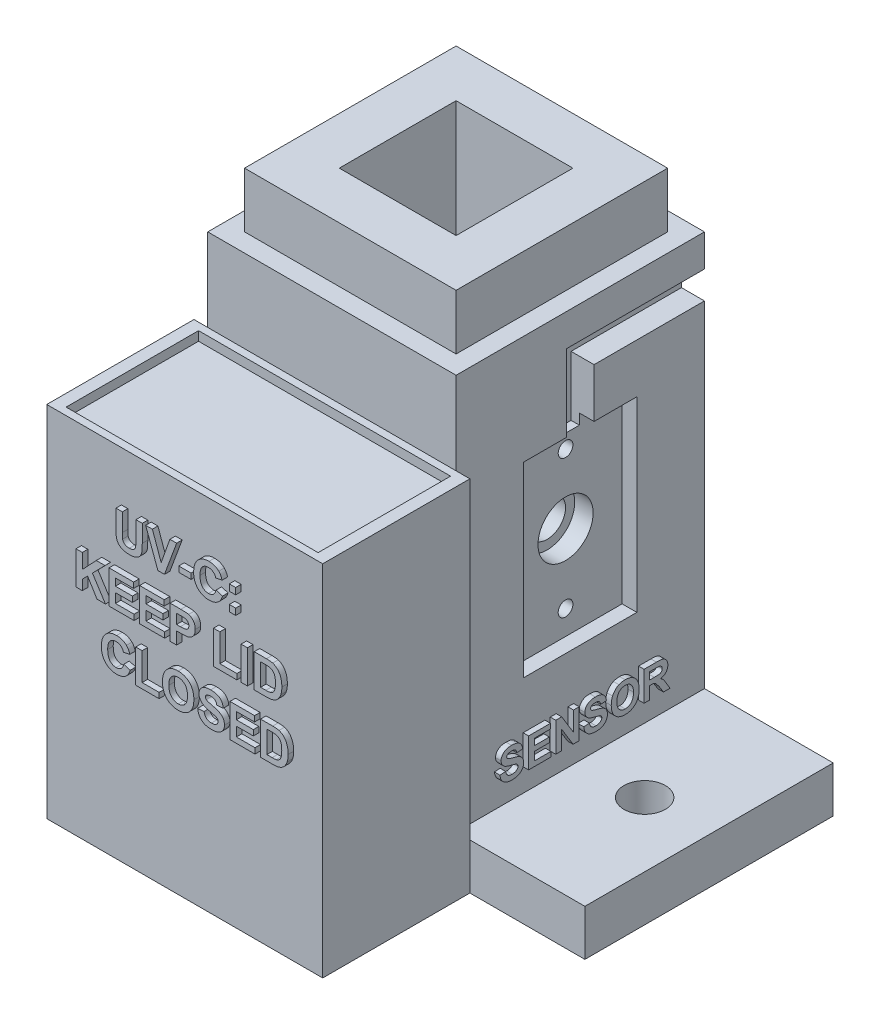
from build123d import *

# Parameters (mm, degrees)
SKETCH1_W                    = 27
SKETCH1_H                    = 27
BLOCK_DEPTH                  = 54
SKETCH2_W                    = 30
SKETCH2_H                    = 16
SWITCH_PILLAR_DEPTH          = 39
CUVETTE_POCKET_START         = 54
SKETCH3_W                    = 12.7
SKETCH3_H                    = 12.7
CUVETTE_POCKET_DEPTH         = 40
LID_STEP_START               = 54
SKETCH4_W                    = 37
SKETCH4_H                    = 37
SKETCH4_W_2                  = 23
SKETCH4_H_2                  = 23
LID_STEP_DEPTH               = 6
OPTICAL_APERTURES_DEPTH      = 64.334429815
OPTICAL_APERTURES_DEPTH_BACK = 64.334429815
SKETCH5_R                    = 2
LED_RECESS_START             = -13.5
SKETCH6_W                    = 20.3
SKETCH6_H                    = 20.3
LED_RECESS_DEPTH             = 1.6
GUVA_RECESS_START            = 13.5
SKETCH7_W                    = 12.3
SKETCH7_H                    = 20.3
GUVA_RECESS_DEPTH            = 1.6
LED_RELIEF_START             = -11.9
SKETCH8_R                    = 3
LED_RELIEF_DEPTH             = 2
SENSOR_RELIEF_START          = 9.9
SKETCH9_R                    = 3
SENSOR_RELIEF_DEPTH          = 2
LED_SCREW_HOLES_M2_START     = -11.9
SKETCH10_R                   = 0.8
LED_SCREW_HOLES_M2_DEPTH     = 4
GUVA_SCREW_HOLES_M2_START    = 11.9
SKETCH11_R                   = 0.8
GUVA_SCREW_HOLES_M2_DEPTH    = 4
LED_CABLE_SLOT_START         = -13.5
LED_CABLE_SLOT_DEPTH         = 2.5
GUVA_CABLE_SLOT_START        = 13.5
GUVA_CABLE_SLOT_DEPTH        = 2.5
REED_SWITCH_SEAT_START       = 39
SKETCH14_W                   = 27.4
SKETCH14_H                   = 14.4
REED_SWITCH_SEAT_DEPTH       = 1
SKETCH15_W                   = 14
SKETCH15_H                   = 27
FOOT_LEFT_DEPTH              = 5
SKETCH16_W                   = 14
SKETCH16_H                   = 27
FOOT_RIGHT_DEPTH             = 5
FOOT_HOLES_M4_START          = -0.5
SKETCH17_R                   = 2.25
FOOT_HOLES_M4_DEPTH          = 6
LABEL_UV_LED_START           = -13.5
LABEL_UV_LED_DEPTH           = 0.6
LABEL_SENSOR_START           = 13.5
LABEL_SENSOR_DEPTH           = 0.6
LABEL_WARNING_1_START        = 29.5
SKETCH20_W                   = 1.338461538
SKETCH20_H                   = 0.6
SKETCH20_W_2                 = 0.692307693
SKETCH20_H_2                 = 0.692307693
SKETCH20_H_3                 = 0.692307692
LABEL_WARNING_1_DEPTH        = 0.6
LABEL_WARNING_2_START        = 29.5
SKETCH21_W                   = 0.692307692
SKETCH21_H                   = 3.6
LABEL_WARNING_2_DEPTH        = 0.6
LABEL_WARNING_3_START        = 29.5
LABEL_WARNING_3_DEPTH        = 0.6


with BuildPart() as part:
    # Sketch1 → Block (new body)
    with BuildSketch(Plane(origin=(0, 0, 0), x_dir=(1, 0, 0), z_dir=(0, 1, 0))):
        Rectangle(SKETCH1_W, SKETCH1_H)
    extrude(amount=BLOCK_DEPTH)

    # Sketch2 → Switch_Pillar (add)
    with BuildSketch(Plane(origin=(0, 0, 0), x_dir=(1, 0, 0), z_dir=(0, 1, 0))):
        with Locations((0, -21.5)):
            Rectangle(SKETCH2_W, SKETCH2_H)
    extrude(amount=SWITCH_PILLAR_DEPTH)

    # Sketch3 → Cuvette_Pocket (cut)
    with BuildSketch(Plane(origin=(0, 0, 0), x_dir=(1, 0, 0), z_dir=(0, 1, 0)).offset(CUVETTE_POCKET_START)):
        Rectangle(SKETCH3_W, SKETCH3_H)
    extrude(amount=-CUVETTE_POCKET_DEPTH, mode=Mode.SUBTRACT)

    # Sketch4 → Lid_Step (cut)
    with BuildSketch(Plane(origin=(0, 0, 0), x_dir=(1, 0, 0), z_dir=(0, 1, 0)).offset(LID_STEP_START)):
        Rectangle(SKETCH4_W, SKETCH4_H)
        Rectangle(SKETCH4_W_2, SKETCH4_H_2, mode=Mode.SUBTRACT)
    extrude(amount=-LID_STEP_DEPTH, mode=Mode.SUBTRACT)

    # Sketch5 → Optical_Apertures (cut, two sides: drawn at the far end of the back side and taken through both)
    with BuildSketch(Plane(origin=(0, 0, 0), x_dir=(0, 0, -1), z_dir=(1, 0, 0)).offset(-OPTICAL_APERTURES_DEPTH_BACK)):
        with Locations(Location((0, 26, 0), (0, 0, 180))):
            Circle(SKETCH5_R)
    extrude(amount=OPTICAL_APERTURES_DEPTH + OPTICAL_APERTURES_DEPTH_BACK, mode=Mode.SUBTRACT)

    # Sketch6 → LED_Recess (cut)
    with BuildSketch(Plane(origin=(0, 0, 0), x_dir=(0, 0, -1), z_dir=(1, 0, 0)).offset(LED_RECESS_START)):
        with Locations((0, 26)):
            Rectangle(SKETCH6_W, SKETCH6_H)
    extrude(amount=LED_RECESS_DEPTH, mode=Mode.SUBTRACT)

    # Sketch7 → GUVA_Recess (cut)
    with BuildSketch(Plane(origin=(0, 0, 0), x_dir=(0, 0, -1), z_dir=(1, 0, 0)).offset(GUVA_RECESS_START)):
        with Locations((0, 26)):
            Rectangle(SKETCH7_W, SKETCH7_H)
    extrude(amount=-GUVA_RECESS_DEPTH, mode=Mode.SUBTRACT)

    # Sketch8 → LED_Relief (cut)
    with BuildSketch(Plane(origin=(0, 0, 0), x_dir=(0, 0, -1), z_dir=(1, 0, 0)).offset(LED_RELIEF_START)):
        with Locations((0, 26)):
            Circle(SKETCH8_R)
    extrude(amount=LED_RELIEF_DEPTH, mode=Mode.SUBTRACT)

    # Sketch9 → Sensor_Relief (cut)
    with BuildSketch(Plane(origin=(0, 0, 0), x_dir=(0, 0, -1), z_dir=(1, 0, 0)).offset(SENSOR_RELIEF_START)):
        with Locations((0, 26)):
            Circle(SKETCH9_R)
    extrude(amount=SENSOR_RELIEF_DEPTH, mode=Mode.SUBTRACT)

    # Sketch10 → LED_Screw_Holes_M2 (cut)
    with BuildSketch(Plane(origin=(0, 0, 0), x_dir=(0, 0, -1), z_dir=(1, 0, 0)).offset(LED_SCREW_HOLES_M2_START)):
        with Locations((7, 19)):
            Circle(SKETCH10_R)
        with Locations((-7, 33)):
            Circle(SKETCH10_R)
    extrude(amount=LED_SCREW_HOLES_M2_DEPTH, mode=Mode.SUBTRACT)

    # Sketch11 → GUVA_Screw_Holes_M2 (cut)
    with BuildSketch(Plane(origin=(0, 0, 0), x_dir=(0, 0, -1), z_dir=(1, 0, 0)).offset(GUVA_SCREW_HOLES_M2_START)):
        with Locations((0, 18.5)):
            Circle(SKETCH11_R)
        with Locations((0, 33.5)):
            Circle(SKETCH11_R)
    extrude(amount=-GUVA_SCREW_HOLES_M2_DEPTH, mode=Mode.SUBTRACT)

    # Sketch12 → LED_Cable_Slot (cut)
    with BuildSketch(Plane(origin=(0, 0, 0), x_dir=(0, 0, -1), z_dir=(1, 0, 0)).offset(LED_CABLE_SLOT_START)):
        Polygon((-1.5, 35), (-1.5, 44.5), (14.5, 44.5), (14.5, 41.5), (1.5, 41.5), (1.5, 35), align=None)
    extrude(amount=LED_CABLE_SLOT_DEPTH, mode=Mode.SUBTRACT)

    # Sketch13 → GUVA_Cable_Slot (cut)
    with BuildSketch(Plane(origin=(0, 0, 0), x_dir=(0, 0, -1), z_dir=(1, 0, 0)).offset(GUVA_CABLE_SLOT_START)):
        Polygon((-1.5, 35), (-1.5, 44.5), (14.5, 44.5), (14.5, 41.5), (1.5, 41.5), (1.5, 35), align=None)
    extrude(amount=-GUVA_CABLE_SLOT_DEPTH, mode=Mode.SUBTRACT)

    # Sketch14 → Reed_Switch_Seat (cut)
    with BuildSketch(Plane(origin=(0, 0, 0), x_dir=(1, 0, 0), z_dir=(0, 1, 0)).offset(REED_SWITCH_SEAT_START)):
        with Locations((0, -21.5)):
            Rectangle(SKETCH14_W, SKETCH14_H)
    extrude(amount=-REED_SWITCH_SEAT_DEPTH, mode=Mode.SUBTRACT)

    # Sketch15 → Foot_Left (add)
    with BuildSketch(Plane(origin=(0, 0, 0), x_dir=(1, 0, 0), z_dir=(0, 1, 0))):
        with Locations((-20.5, 0)):
            Rectangle(SKETCH15_W, SKETCH15_H)
    extrude(amount=FOOT_LEFT_DEPTH)

    # Sketch16 → Foot_Right (add)
    with BuildSketch(Plane(origin=(0, 0, 0), x_dir=(1, 0, 0), z_dir=(0, 1, 0))):
        with Locations((20.5, 0)):
            Rectangle(SKETCH16_W, SKETCH16_H)
    extrude(amount=FOOT_RIGHT_DEPTH)

    # Sketch17 → Foot_Holes_M4 (cut)
    with BuildSketch(Plane(origin=(0, 0, 0), x_dir=(1, 0, 0), z_dir=(0, 1, 0)).offset(FOOT_HOLES_M4_START)):
        with Locations(Location((-20.5, 0, 0), (0, 0, 90))):
            Circle(SKETCH17_R)
        with Locations(Location((20.5, 0, 0), (0, 0, 90))):
            Circle(SKETCH17_R)
    extrude(amount=FOOT_HOLES_M4_DEPTH, mode=Mode.SUBTRACT)

    # Sketch18 → Label_UV_LED (add)
    # profile 1 of 5: a face of its own
    with BuildSketch(Plane(origin=(0, 0, 0), x_dir=(0, 0, -1), z_dir=(1, 0, 0)).offset(LABEL_UV_LED_START)):
        with BuildLine():
            Line((8.171794872, 10.7), (7.556410256, 10.7))
            Line((7.556410256, 10.7), (7.556410256, 8.963461538))
            add(Edge.make_bspline(
                [(7.556410256, 8.963461538), (7.556175325, 8.930555592), (7.55572682, 8.867735016), (7.555418088, 8.777983762), (7.553709529, 8.697401017), (7.550004353, 8.625856935), (7.547461388, 8.563388001), (7.542739378, 8.509982752), (7.538028812, 8.465661985), (7.533449011, 8.439299626), (7.531410256, 8.427564103)],
                knots=[0, 0, 0, 0, 1.470600056, 2.807515117, 4.011048972, 5.072079398, 6.00911328, 6.804506435, 7.467811572, 8, 8, 8, 8], degree=3))
            add(Edge.make_bspline(
                [(7.531410256, 8.427564103), (7.523004979, 8.395926847), (7.506453927, 8.333629097), (7.46083314, 8.248469727), (7.400568725, 8.173407105), (7.339096799, 8.119875373), (7.283490707, 8.081989585), (7.236257889, 8.058931748), (7.186144176, 8.037913047), (7.13209014, 8.021785575), (7.074675921, 8.007673458), (7.013208015, 7.999513733), (6.948205175, 7.993251346), (6.903649868, 7.992627869), (6.880769231, 7.992307692)],
                knots=[0, 0, 0, 0, 1.376921055, 2.711331395, 4.038631339, 5.418057255, 6.132954575, 6.870556231, 7.630397752, 8.422890386, 9.247036838, 10.121396817, 11.035274583, 12, 12, 12, 12], degree=3))
            add(Edge.make_bspline(
                [(6.880769231, 7.992307692), (6.85768517, 7.992726365), (6.812740974, 7.993541512), (6.747609162, 7.998395998), (6.686842295, 8.007554739), (6.630477546, 8.019563618), (6.578217217, 8.034740828), (6.530478232, 8.05395696), (6.487335821, 8.077081833), (6.436644139, 8.11193673), (6.382099955, 8.161105648), (6.329608142, 8.227957072), (6.292040162, 8.301753772), (6.274419187, 8.369135679), (6.265362597, 8.427843466), (6.259844836, 8.479214818), (6.254798565, 8.537349363), (6.250216164, 8.602087873), (6.24708239, 8.67347894), (6.245387386, 8.751703117), (6.244053409, 8.83674793), (6.243747983, 8.89572592), (6.243589744, 8.926282051)],
                knots=[0, 0, 0, 0, 1.036876239, 2.018776863, 2.930845756, 3.794842666, 4.605604932, 5.371924355, 6.101864688, 6.799283669, 8.1310906, 9.382718023, 10.597336334, 11.822035891, 12.492591141, 13.265194674, 14.141890321, 15.11351293, 16.179860579, 17.351049011, 18.627594861, 20, 20, 20, 20], degree=3))
            Line((6.243589744, 8.926282051), (6.243589744, 10.7))
            Line((6.243589744, 10.7), (5.628205128, 10.7))
            Line((5.628205128, 10.7), (5.628205128, 9.026282051))
            add(Edge.make_bspline(
                [(5.628205128, 9.026282051), (5.628284003, 8.980127743), (5.62843556, 8.891443509), (5.630801902, 8.763849021), (5.635831129, 8.646786428), (5.640042673, 8.540055067), (5.648166568, 8.44392722), (5.656672258, 8.358343118), (5.667629524, 8.283317719), (5.683254687, 8.19804045), (5.709513789, 8.102364842), (5.751834434, 7.996678862), (5.80592149, 7.900527243), (5.871559432, 7.813541062), (5.948370131, 7.735374589), (6.037503666, 7.666335122), (6.138043481, 7.605583338), (6.230176609, 7.561838256), (6.310504893, 7.532381752), (6.375930938, 7.51244691), (6.445951807, 7.495845357), (6.520485379, 7.482670549), (6.59956368, 7.471562236), (6.683215422, 7.464143703), (6.771314048, 7.459514015), (6.831404122, 7.459157136), (6.862179487, 7.458974359)],
                knots=[0, 0, 0, 0, 1.415574045, 2.719986624, 3.913607924, 5.00929969, 5.995467356, 6.871900228, 7.64671288, 8.320227872, 9.530145585, 10.682614022, 11.803571353, 12.90325401, 14.015460715, 15.154679255, 16.351678057, 17.612271512, 18.275764165, 18.974412946, 19.708786676, 20.481351116, 21.295095879, 22.157200529, 23.056203067, 24, 24, 24, 24], degree=3))
            add(Edge.make_bspline(
                [(6.862179487, 7.458974359), (6.89914789, 7.459446911), (6.970761196, 7.460362315), (7.074713864, 7.464445855), (7.171571297, 7.472874436), (7.261637803, 7.484266453), (7.344876195, 7.498911263), (7.421497047, 7.516419042), (7.490888653, 7.538546404), (7.573539625, 7.570149627), (7.66566792, 7.618491963), (7.765953467, 7.682980246), (7.853986932, 7.755766724), (7.928994807, 7.836140181), (7.991698471, 7.921276112), (8.042665472, 8.009332268), (8.083508749, 8.098840955), (8.100575388, 8.161051243), (8.108974359, 8.191666667)],
                knots=[0, 0, 0, 0, 1.128613534, 2.186292659, 3.174878439, 4.095586888, 4.95671962, 5.754129884, 6.492676435, 7.178284149, 8.453103036, 9.659838108, 10.813193309, 11.929983019, 13.007587775, 14.033493319, 15.032227051, 16, 16, 16, 16], degree=3))
            add(Edge.make_bspline(
                [(8.108974359, 8.191666667), (8.114114825, 8.215769851), (8.12494229, 8.266538866), (8.137239285, 8.347251647), (8.148457768, 8.436129937), (8.156120138, 8.533278863), (8.163383363, 8.638390191), (8.168598102, 8.751662108), (8.170742407, 8.873068893), (8.171436983, 8.956837258), (8.171794872, 9)],
                knots=[0, 0, 0, 0, 0.728071598, 1.533551606, 2.411422299, 3.374601532, 4.412367648, 5.524718474, 6.72457895, 8, 8, 8, 8], degree=3))
            Line((8.171794872, 9), (8.171794872, 10.7))
        make_face()
    # profile 2 of 5: a face of its own
    with BuildSketch(Plane(origin=(0, 0, 0), x_dir=(0, 0, -1), z_dir=(1, 0, 0)).offset(LABEL_UV_LED_START)):
        Polygon((4.116666667, 7.5), (5.3, 10.7), (4.65, 10.7), (3.802564103, 8.320512821), (2.958974359, 10.7), (2.305128205, 10.7), (3.483333333, 7.5), align=None)
    # profile 3 of 5: a face of its own
    with BuildSketch(Plane(origin=(0, 0, 0), x_dir=(0, 0, -1), z_dir=(1, 0, 0)).offset(LABEL_UV_LED_START)):
        Polygon((0.787179487, 7.5), (0.787179487, 10.7), (0.171794872, 10.7), (0.171794872, 8.033333333), (-1.469230769, 8.033333333), (-1.469230769, 7.5), align=None)
    # profile 4 of 5: a face of its own
    with BuildSketch(Plane(origin=(0, 0, 0), x_dir=(0, 0, -1), z_dir=(1, 0, 0)).offset(LABEL_UV_LED_START)):
        Polygon((-1.920512821, 7.5), (-1.920512821, 10.7), (-4.3, 10.7), (-4.3, 10.166666667), (-2.535897436, 10.166666667), (-2.535897436, 9.469230769), (-4.176923077, 9.469230769), (-4.176923077, 8.935897436), (-2.535897436, 8.935897436), (-2.535897436, 8.033333333), (-4.341025641, 8.033333333), (-4.341025641, 7.5), align=None)
    # profile 5 of 5: a face of its own
    with BuildSketch(Plane(origin=(0, 0, 0), x_dir=(0, 0, -1), z_dir=(1, 0, 0)).offset(LABEL_UV_LED_START)):
        with BuildLine():
            Line((-4.874358974, 10.7), (-6.048076923, 10.7))
            add(Edge.make_bspline(
                [(-6.048076923, 10.7), (-6.080133066, 10.700016618), (-6.142553822, 10.700048978), (-6.233142681, 10.696290856), (-6.317854911, 10.69251068), (-6.396447367, 10.684943593), (-6.469192709, 10.677011945), (-6.536221477, 10.666969881), (-6.597110247, 10.654099878), (-6.63550667, 10.64395034), (-6.653846154, 10.639102564)],
                knots=[0, 0, 0, 0, 1.259756885, 2.453039283, 3.563158368, 4.591894114, 5.55549294, 6.43918076, 7.254497783, 8, 8, 8, 8], degree=3))
            add(Edge.make_bspline(
                [(-6.653846154, 10.639102564), (-6.676780799, 10.631627805), (-6.722236981, 10.616812926), (-6.788877143, 10.590854791), (-6.852015227, 10.558661469), (-6.91399358, 10.524820298), (-6.972045312, 10.48480705), (-7.029242634, 10.443178621), (-7.081873533, 10.394956441), (-7.150892187, 10.327562769), (-7.229647718, 10.233681252), (-7.312156137, 10.109152139), (-7.381991303, 9.972464304), (-7.429705899, 9.849996763), (-7.461924647, 9.745889008), (-7.482985691, 9.662420987), (-7.500875766, 9.574498072), (-7.515563574, 9.482098098), (-7.526975577, 9.385221053), (-7.535471936, 9.283892758), (-7.539610519, 9.178025679), (-7.540547562, 9.105985568), (-7.541025641, 9.069230769)],
                knots=[0, 0, 0, 0, 0.745524535, 1.477620414, 2.207090574, 2.934465325, 3.657932502, 4.384347339, 5.118673636, 5.861150177, 7.365375624, 8.894729774, 10.468936425, 12.099947606, 12.950091786, 13.83580991, 14.759228729, 15.722225242, 16.726454549, 17.773376212, 18.863978586, 20, 20, 20, 20], degree=3))
            add(Edge.make_bspline(
                [(-7.541025641, 9.069230769), (-7.540152928, 9.005707196), (-7.538465118, 8.882853881), (-7.518911737, 8.70557706), (-7.490732845, 8.540919063), (-7.458969389, 8.438198245), (-7.443589744, 8.388461538)],
                knots=[0, 0, 0, 0, 1.103207939, 2.133582005, 3.096293362, 4, 4, 4, 4], degree=3))
            add(Edge.make_bspline(
                [(-7.443589744, 8.388461538), (-7.433434082, 8.359921532), (-7.413456311, 8.303778886), (-7.37849671, 8.222792844), (-7.340722614, 8.145722648), (-7.299820702, 8.072629018), (-7.255584326, 8.003840731), (-7.207848027, 7.939563539), (-7.157351753, 7.878951211), (-7.120770125, 7.841644037), (-7.102564103, 7.823076923)],
                knots=[0, 0, 0, 0, 1.090884612, 2.145940218, 3.175104604, 4.181306866, 5.161203701, 6.118658341, 7.063689906, 8, 8, 8, 8], degree=3))
            add(Edge.make_bspline(
                [(-7.102564103, 7.823076923), (-7.07310236, 7.796581746), (-7.012348047, 7.741944915), (-6.905288543, 7.674329653), (-6.784281199, 7.614582949), (-6.696751884, 7.583892058), (-6.651282051, 7.567948718)],
                knots=[0, 0, 0, 0, 0.908140292, 1.872714733, 2.8949153, 4, 4, 4, 4], degree=3))
            add(Edge.make_bspline(
                [(-6.651282051, 7.567948718), (-6.632978136, 7.56232704), (-6.594989306, 7.55065954), (-6.534754272, 7.538198407), (-6.470451861, 7.525070481), (-6.401340578, 7.517162016), (-6.328137832, 7.50882219), (-6.250260263, 7.504139843), (-6.167977834, 7.500815649), (-6.111542333, 7.500275914), (-6.082692308, 7.5)],
                knots=[0, 0, 0, 0, 0.799129865, 1.658552685, 2.566799617, 3.538529252, 4.561352959, 5.643373779, 6.795284424, 8, 8, 8, 8], degree=3))
            Line((-6.082692308, 7.5), (-4.874358974, 7.5))
            Line((-4.874358974, 7.5), (-4.874358974, 10.7))
        make_face()
        with BuildLine():
            Line((-5.48974359, 10.166666667), (-5.48974359, 8.033333333))
            Line((-5.48974359, 8.033333333), (-5.996153846, 8.033333333))
            add(Edge.make_bspline(
                [(-5.996153846, 8.033333333), (-6.019016942, 8.033514653), (-6.063037134, 8.033863764), (-6.126735481, 8.034889581), (-6.185273725, 8.037666665), (-6.238958527, 8.040543272), (-6.287650124, 8.045295929), (-6.33156038, 8.049970348), (-6.370444871, 8.056509762), (-6.394460887, 8.06167189), (-6.405769231, 8.064102564)],
                knots=[0, 0, 0, 0, 1.333384787, 2.567275092, 3.714769766, 4.750907381, 5.701951617, 6.567520054, 7.325492842, 8, 8, 8, 8], degree=3))
            add(Edge.make_bspline(
                [(-6.405769231, 8.064102564), (-6.432254653, 8.071170189), (-6.48384127, 8.084936057), (-6.556274095, 8.11562414), (-6.621816469, 8.152645954), (-6.681566028, 8.197163094), (-6.735412748, 8.253422463), (-6.781377507, 8.325373784), (-6.823916679, 8.411185885), (-6.853047514, 8.493329526), (-6.873957572, 8.566698305), (-6.888111965, 8.628278532), (-6.8992978, 8.69490211), (-6.908919077, 8.766306101), (-6.916693297, 8.842398683), (-6.921530785, 8.923454637), (-6.9248324, 9.009374745), (-6.925366378, 9.068372713), (-6.925641026, 9.098717949)],
                knots=[0, 0, 0, 0, 1.038686998, 2.023088296, 2.974059649, 3.888265163, 4.839857954, 5.909819677, 7.113156087, 8.466843969, 9.20827164, 10.006482943, 10.861893492, 11.769681931, 12.739021491, 13.762258324, 14.849031541, 16, 16, 16, 16], degree=3))
            add(Edge.make_bspline(
                [(-6.925641026, 9.098717949), (-6.92536849, 9.129063278), (-6.924840536, 9.187847898), (-6.921543985, 9.273127345), (-6.91673367, 9.352906894), (-6.908904084, 9.427285166), (-6.899431953, 9.496364955), (-6.888115095, 9.560204721), (-6.874046027, 9.618385501), (-6.853118183, 9.687505343), (-6.821392651, 9.765198192), (-6.778220393, 9.850143351), (-6.725203375, 9.922544502), (-6.666624732, 9.985440566), (-6.599082567, 10.037200848), (-6.524313553, 10.080553099), (-6.440689757, 10.114201413), (-6.381205523, 10.128533334), (-6.350641026, 10.135897436)],
                knots=[0, 0, 0, 0, 1.117996097, 2.165769068, 3.143980016, 4.062055362, 4.920439205, 5.712587309, 6.449616741, 7.124491204, 8.371470382, 9.537068822, 10.625202851, 11.666538334, 12.693249444, 13.747832046, 14.842779399, 16, 16, 16, 16], degree=3))
            add(Edge.make_bspline(
                [(-6.350641026, 10.135897436), (-6.337411222, 10.138355719), (-6.308284259, 10.143767916), (-6.259950867, 10.150089394), (-6.203245029, 10.154780471), (-6.137877668, 10.159569649), (-6.064113464, 10.16230316), (-5.981643769, 10.165156024), (-5.89081368, 10.166130557), (-5.8273502, 10.166482828), (-5.794230769, 10.166666667)],
                knots=[0, 0, 0, 0, 0.578738571, 1.274160813, 2.095454135, 3.025967819, 4.093109015, 5.270126069, 6.575371698, 8, 8, 8, 8], degree=3))
            Line((-5.794230769, 10.166666667), (-5.48974359, 10.166666667))
        make_face(mode=Mode.SUBTRACT)
    extrude(amount=-LABEL_UV_LED_DEPTH)

    # Sketch19 → Label_SENSOR (add)
    # profile 1 of 6: a face of its own
    with BuildSketch(Plane(origin=(0, 0, 0), x_dir=(0, 0, -1), z_dir=(1, 0, 0)).offset(LABEL_SENSOR_START)):
        with BuildLine():
            Line((-9.335897436, 8.566666667), (-8.720512821, 8.607692308))
            add(Edge.make_bspline(
                [(-8.720512821, 8.607692308), (-8.715610225, 8.581946782), (-8.706087247, 8.531937737), (-8.684928975, 8.46066802), (-8.661639575, 8.394224431), (-8.633807464, 8.333319466), (-8.603338413, 8.27682733), (-8.567729376, 8.22635735), (-8.52946453, 8.180298145), (-8.486649692, 8.140303968), (-8.440003481, 8.105276514), (-8.389293139, 8.075403935), (-8.335068154, 8.049548678), (-8.277195941, 8.028257694), (-8.215080037, 8.012363871), (-8.149261564, 8.001056357), (-8.079646125, 7.993815338), (-8.032069517, 7.992818467), (-8.007692308, 7.992307692)],
                knots=[0, 0, 0, 0, 1.204560339, 2.339781841, 3.415289417, 4.440034832, 5.416475564, 6.362424008, 7.275913008, 8.16578645, 9.05021719, 9.95355393, 10.867835453, 11.809845306, 12.784702352, 13.812224031, 14.87903166, 16, 16, 16, 16], degree=3))
            add(Edge.make_bspline(
                [(-8.007692308, 7.992307692), (-7.982033753, 7.992587626), (-7.932126543, 7.99313211), (-7.859805478, 7.999886919), (-7.792181997, 8.00956391), (-7.729853239, 8.024882359), (-7.671655274, 8.04201362), (-7.619033499, 8.065451011), (-7.571136366, 8.092482653), (-7.52808727, 8.123156563), (-7.490518284, 8.15717613), (-7.45765106, 8.192691455), (-7.42902588, 8.228935243), (-7.406495836, 8.267515835), (-7.388262575, 8.306872873), (-7.376211665, 8.348180445), (-7.368070563, 8.390490039), (-7.367137015, 8.419405763), (-7.366666667, 8.433974359)],
                knots=[0, 0, 0, 0, 1.417779877, 2.757654889, 4.012140507, 5.189587551, 6.302846416, 7.360586765, 8.365575446, 9.33904572, 10.275781718, 11.161696098, 12.012180333, 12.822428111, 13.625933072, 14.403138519, 15.195454004, 16, 16, 16, 16], degree=3))
            add(Edge.make_bspline(
                [(-7.366666667, 8.433974359), (-7.367243509, 8.452227628), (-7.368372018, 8.487937478), (-7.381958127, 8.53898862), (-7.402332686, 8.586286028), (-7.433009732, 8.629131119), (-7.474247231, 8.668285288), (-7.526849772, 8.704913054), (-7.592285671, 8.737863719), (-7.640830596, 8.756243661), (-7.666666667, 8.766025641)],
                knots=[0, 0, 0, 0, 0.90494901, 1.770400303, 2.607161909, 3.452839393, 4.36912122, 5.420987164, 6.627424851, 8, 8, 8, 8], degree=3))
            add(Edge.make_bspline(
                [(-7.666666667, 8.766025641), (-7.677752241, 8.769740468), (-7.702559954, 8.778053647), (-7.74487928, 8.78994071), (-7.795854033, 8.804784493), (-7.856220829, 8.821656822), (-7.925959371, 8.838912773), (-8.00429077, 8.860170146), (-8.092169973, 8.88132297), (-8.153650369, 8.89693798), (-8.185897436, 8.905128205)],
                knots=[0, 0, 0, 0, 0.521821638, 1.167752076, 1.961721917, 2.891982557, 3.96540661, 5.168436773, 6.514817513, 8, 8, 8, 8], degree=3))
            add(Edge.make_bspline(
                [(-8.185897436, 8.905128205), (-8.227892687, 8.915613439), (-8.308915657, 8.935842984), (-8.424472966, 8.971829911), (-8.530903361, 9.007584915), (-8.62718209, 9.046381013), (-8.714371146, 9.085588889), (-8.791060222, 9.127961196), (-8.858849648, 9.17129739), (-8.898352121, 9.203687919), (-8.917307692, 9.219230769)],
                knots=[0, 0, 0, 0, 1.293880989, 2.496331788, 3.617634808, 4.64976062, 5.598842568, 6.473791081, 7.267636666, 8, 8, 8, 8], degree=3))
            add(Edge.make_bspline(
                [(-8.917307692, 9.219230769), (-8.940815065, 9.241240621), (-8.986903443, 9.284392971), (-9.04757164, 9.355300565), (-9.098549444, 9.430203092), (-9.140509759, 9.508547672), (-9.172818407, 9.590785332), (-9.195718362, 9.676365608), (-9.210540044, 9.765511854), (-9.212052495, 9.826222559), (-9.212820513, 9.857051282)],
                knots=[0, 0, 0, 0, 1.064429417, 2.086912298, 3.078678339, 4.055528992, 5.020032834, 5.993708893, 6.981211098, 8, 8, 8, 8], degree=3))
            add(Edge.make_bspline(
                [(-9.212820513, 9.857051282), (-9.211324791, 9.896943282), (-9.208357727, 9.976077102), (-9.18114781, 10.092393015), (-9.138762194, 10.204628912), (-9.08960493, 10.293748371), (-9.042375405, 10.361167579), (-9.003154723, 10.409546985), (-8.960067015, 10.454825458), (-8.91252207, 10.495898514), (-8.86228535, 10.535172035), (-8.807410492, 10.570047392), (-8.749453362, 10.602898049), (-8.665582793, 10.641840975), (-8.551709574, 10.682423328), (-8.403554399, 10.716631677), (-8.24224275, 10.737195313), (-8.130404887, 10.739718036), (-8.072435897, 10.741025641)],
                knots=[0, 0, 0, 0, 1.180131776, 2.341029169, 3.518901375, 4.725685298, 5.343762192, 5.955650671, 6.568945152, 7.192346361, 7.815201106, 8.455999361, 9.116257477, 9.787318263, 11.192748436, 12.688084276, 14.283332633, 16, 16, 16, 16], degree=3))
            add(Edge.make_bspline(
                [(-8.072435897, 10.741025641), (-8.024970839, 10.740390914), (-7.932652316, 10.739156384), (-7.798825893, 10.726672619), (-7.673824753, 10.707243115), (-7.55808754, 10.679352152), (-7.451560328, 10.64250087), (-7.353830186, 10.598604025), (-7.264980162, 10.546487455), (-7.186091916, 10.485852082), (-7.115810051, 10.419005472), (-7.054500363, 10.345989573), (-7.001928454, 10.26772653), (-6.957755032, 10.184273539), (-6.923065759, 10.095201529), (-6.897587858, 10.000621644), (-6.880736553, 9.900756501), (-6.876512722, 9.832327908), (-6.874358974, 9.797435897)],
                knots=[0, 0, 0, 0, 1.325124071, 2.577337985, 3.749592149, 4.855247722, 5.896868755, 6.892903601, 7.842551483, 8.766257401, 9.665194363, 10.546067736, 11.423174165, 12.293291263, 13.177512979, 14.086532529, 15.024315359, 16, 16, 16, 16], degree=3))
            Line((-6.874358974, 9.797435897), (-7.48974359, 9.756410256))
            add(Edge.make_bspline(
                [(-7.48974359, 9.756410256), (-7.493293588, 9.775707068), (-7.500212166, 9.813314545), (-7.515255049, 9.867176095), (-7.53222269, 9.916991884), (-7.552082436, 9.962761594), (-7.576070609, 10.003665446), (-7.602176635, 10.040990297), (-7.63112066, 10.074238814), (-7.663861032, 10.102500545), (-7.699272652, 10.128217563), (-7.739629419, 10.148830347), (-7.783240339, 10.167954474), (-7.831764544, 10.182331128), (-7.884270193, 10.193735206), (-7.940787869, 10.202189449), (-8.001434727, 10.206317286), (-8.04315753, 10.207223474), (-8.06474359, 10.207692308)],
                knots=[0, 0, 0, 0, 1.151066407, 2.24330871, 3.278475654, 4.238599069, 5.165719782, 6.056502506, 6.909492653, 7.744782051, 8.590364415, 9.471203867, 10.39832458, 11.382154319, 12.435022857, 13.550631277, 14.73277401, 16, 16, 16, 16], degree=3))
            add(Edge.make_bspline(
                [(-8.06474359, 10.207692308), (-8.087187197, 10.207278405), (-8.130852238, 10.206473139), (-8.194483841, 10.201531338), (-8.254175059, 10.192409249), (-8.310219052, 10.180534552), (-8.362540958, 10.164379848), (-8.411030363, 10.144681833), (-8.45590911, 10.121491206), (-8.483274212, 10.103245621), (-8.496794872, 10.094230769)],
                knots=[0, 0, 0, 0, 1.186678824, 2.308736671, 3.37120409, 4.377216403, 5.334874112, 6.262130804, 7.141346615, 8, 8, 8, 8], degree=3))
            add(Edge.make_bspline(
                [(-8.496794872, 10.094230769), (-8.512268132, 10.081916225), (-8.542235033, 10.058066777), (-8.57448576, 10.01070988), (-8.593900772, 9.957221685), (-8.596237589, 9.919396548), (-8.597435897, 9.9)],
                knots=[0, 0, 0, 0, 1.037857257, 2.010007357, 2.979541333, 4, 4, 4, 4], degree=3))
            add(Edge.make_bspline(
                [(-8.597435897, 9.9), (-8.5964559, 9.881872638), (-8.59452546, 9.846164619), (-8.575054487, 9.795440605), (-8.545110784, 9.748441157), (-8.517133305, 9.722910442), (-8.502564103, 9.709615385)],
                knots=[0, 0, 0, 0, 0.98538058, 1.941042925, 2.927803204, 4, 4, 4, 4], degree=3))
            add(Edge.make_bspline(
                [(-8.502564103, 9.709615385), (-8.491001563, 9.700986226), (-8.465164099, 9.681703647), (-8.417834988, 9.657193665), (-8.360707508, 9.630647875), (-8.292479291, 9.604696433), (-8.213603781, 9.578793165), (-8.12407618, 9.551747158), (-8.023841426, 9.524338033), (-7.915454453, 9.497793638), (-7.805411149, 9.471702022), (-7.700399856, 9.443176522), (-7.602754454, 9.415366366), (-7.512927699, 9.386216809), (-7.430456548, 9.357839806), (-7.355741618, 9.32869458), (-7.288269888, 9.300310391), (-7.20959037, 9.261280121), (-7.12041505, 9.208412042), (-7.026949255, 9.131559473), (-6.944290687, 9.045172166), (-6.886696393, 8.963714895), (-6.847132126, 8.893659474), (-6.821656913, 8.837817146), (-6.799618856, 8.778973413), (-6.781679937, 8.717063248), (-6.768678537, 8.651999537), (-6.757919123, 8.584279366), (-6.752421938, 8.513340305), (-6.751666103, 8.464964913), (-6.751282051, 8.440384615)],
                knots=[0, 0, 0, 0, 0.511875881, 1.143829537, 1.88775736, 2.750598373, 3.734912702, 4.837306479, 6.073130119, 7.42648979, 8.801963576, 10.091065733, 11.292408984, 12.408830014, 13.446061236, 14.39066453, 15.257936293, 16.045629259, 17.510392066, 18.929669597, 20.331293837, 21.746891395, 22.460690638, 23.187651344, 23.925159671, 24.69163991, 25.474819891, 26.281170188, 27.126635539, 28, 28, 28, 28], degree=3))
            add(Edge.make_bspline(
                [(-6.751282051, 8.440384615), (-6.751810135, 8.417716086), (-6.752858857, 8.372698581), (-6.760187615, 8.305881241), (-6.771521354, 8.240250452), (-6.788299183, 8.17572394), (-6.810556684, 8.112428642), (-6.835616862, 8.04945103), (-6.866953204, 7.988164516), (-6.902618235, 7.928518337), (-6.941958384, 7.870557256), (-6.986538081, 7.817089479), (-7.033738887, 7.766331192), (-7.086576809, 7.721124575), (-7.141788986, 7.677809225), (-7.201900767, 7.639448423), (-7.26550382, 7.604735294), (-7.333000295, 7.573929005), (-7.404629506, 7.54708411), (-7.480298421, 7.523190286), (-7.56068877, 7.503635026), (-7.645130215, 7.486873706), (-7.733931771, 7.474127154), (-7.826982418, 7.465227098), (-7.92430331, 7.460208002), (-7.990592698, 7.459390683), (-8.024358974, 7.458974359)],
                knots=[0, 0, 0, 0, 0.900570041, 1.788444861, 2.667795364, 3.545012114, 4.433698372, 5.332345486, 6.235991676, 7.164928091, 8.092777575, 9.015680987, 9.928493428, 10.842962589, 11.775229507, 12.714851019, 13.672254427, 14.652424454, 15.660007982, 16.709910502, 17.803296389, 18.945495772, 20.129342395, 21.366102753, 22.658353839, 24, 24, 24, 24], degree=3))
            add(Edge.make_bspline(
                [(-8.024358974, 7.458974359), (-8.073112268, 7.459770339), (-8.168036086, 7.461320132), (-8.305943346, 7.475191997), (-8.435291226, 7.496423886), (-8.555869158, 7.527238519), (-8.667824517, 7.566797552), (-8.771106242, 7.615525546), (-8.865214771, 7.673713625), (-8.951315688, 7.73995063), (-9.028261834, 7.815443566), (-9.097451964, 7.898628248), (-9.157952683, 7.99025374), (-9.209724224, 8.090176727), (-9.254075461, 8.197857028), (-9.290652354, 8.313344087), (-9.318192831, 8.437188715), (-9.329893834, 8.52276091), (-9.335897436, 8.566666667)],
                knots=[0, 0, 0, 0, 1.217954099, 2.371385517, 3.459848295, 4.490682126, 5.476952527, 6.422732854, 7.338496285, 8.236688651, 9.131557988, 10.026443255, 10.935708282, 11.869506048, 12.834296687, 13.842423496, 14.892981177, 16, 16, 16, 16], degree=3))
        make_face()
    # profile 2 of 6: a face of its own
    with BuildSketch(Plane(origin=(0, 0, 0), x_dir=(0, 0, -1), z_dir=(1, 0, 0)).offset(LABEL_SENSOR_START)):
        Polygon((-6.217948718, 7.5), (-6.217948718, 10.7), (-3.838461538, 10.7), (-3.838461538, 10.166666667), (-5.602564103, 10.166666667), (-5.602564103, 9.469230769), (-3.961538462, 9.469230769), (-3.961538462, 8.935897436), (-5.602564103, 8.935897436), (-5.602564103, 8.033333333), (-3.797435897, 8.033333333), (-3.797435897, 7.5), align=None)
    # profile 3 of 6: a face of its own
    with BuildSketch(Plane(origin=(0, 0, 0), x_dir=(0, 0, -1), z_dir=(1, 0, 0)).offset(LABEL_SENSOR_START)):
        Polygon((-3.264102564, 7.5), (-3.264102564, 10.7), (-2.621153846, 10.7), (-1.335897436, 8.596153846), (-1.335897436, 10.7), (-0.720512821, 10.7), (-0.720512821, 7.5), (-1.383333333, 7.5), (-2.648717949, 9.570512821), (-2.648717949, 7.5), align=None)
    # profile 4 of 6: a face of its own
    with BuildSketch(Plane(origin=(0, 0, 0), x_dir=(0, 0, -1), z_dir=(1, 0, 0)).offset(LABEL_SENSOR_START)):
        with BuildLine():
            Line((-0.228205128, 8.566666667), (0.387179487, 8.607692308))
            add(Edge.make_bspline(
                [(0.387179487, 8.607692308), (0.392082082, 8.581946782), (0.401605061, 8.531937737), (0.422763332, 8.46066802), (0.446052733, 8.394224431), (0.473884843, 8.333319466), (0.504353895, 8.27682733), (0.539962932, 8.22635735), (0.578227778, 8.180298145), (0.621042616, 8.140303968), (0.667688826, 8.105276514), (0.718399169, 8.075403935), (0.772624154, 8.049548678), (0.830496367, 8.028257694), (0.89261227, 8.012363871), (0.958430744, 8.001056357), (1.028046182, 7.993815338), (1.075622791, 7.992818467), (1.1, 7.992307692)],
                knots=[0, 0, 0, 0, 1.204560339, 2.339781841, 3.415289417, 4.440034832, 5.416475564, 6.362424008, 7.275913008, 8.16578645, 9.05021719, 9.95355393, 10.867835453, 11.809845306, 12.784702352, 13.812224031, 14.87903166, 16, 16, 16, 16], degree=3))
            add(Edge.make_bspline(
                [(1.1, 7.992307692), (1.125658554, 7.992587626), (1.175565764, 7.99313211), (1.24788683, 7.999886919), (1.315510311, 8.00956391), (1.377839069, 8.024882359), (1.436037033, 8.04201362), (1.488658809, 8.065451011), (1.536555942, 8.092482653), (1.579605037, 8.123156563), (1.617174023, 8.15717613), (1.650041247, 8.192691455), (1.678666428, 8.228935243), (1.701196471, 8.267515835), (1.719429733, 8.306872873), (1.731480642, 8.348180445), (1.739621745, 8.390490039), (1.740555292, 8.419405763), (1.741025641, 8.433974359)],
                knots=[0, 0, 0, 0, 1.417779877, 2.757654889, 4.012140507, 5.189587551, 6.302846416, 7.360586765, 8.365575446, 9.33904572, 10.275781718, 11.161696098, 12.012180333, 12.822428111, 13.625933072, 14.403138519, 15.195454004, 16, 16, 16, 16], degree=3))
            add(Edge.make_bspline(
                [(1.741025641, 8.433974359), (1.740448798, 8.452227628), (1.73932029, 8.487937478), (1.72573418, 8.53898862), (1.705359621, 8.586286028), (1.674682576, 8.629131119), (1.633445076, 8.668285288), (1.580842536, 8.704913054), (1.515406637, 8.737863719), (1.466861712, 8.756243661), (1.441025641, 8.766025641)],
                knots=[0, 0, 0, 0, 0.90494901, 1.770400303, 2.607161909, 3.452839393, 4.36912122, 5.420987164, 6.627424851, 8, 8, 8, 8], degree=3))
            add(Edge.make_bspline(
                [(1.441025641, 8.766025641), (1.429940067, 8.769740468), (1.405132353, 8.778053647), (1.362813027, 8.78994071), (1.311838275, 8.804784493), (1.251471479, 8.821656822), (1.181732937, 8.838912773), (1.103401538, 8.860170146), (1.015522335, 8.88132297), (0.954041938, 8.89693798), (0.921794872, 8.905128205)],
                knots=[0, 0, 0, 0, 0.521821638, 1.167752076, 1.961721917, 2.891982557, 3.96540661, 5.168436773, 6.514817513, 8, 8, 8, 8], degree=3))
            add(Edge.make_bspline(
                [(0.921794872, 8.905128205), (0.87979962, 8.915613439), (0.79877665, 8.935842984), (0.683219341, 8.971829911), (0.576788946, 9.007584915), (0.480510218, 9.046381013), (0.393321161, 9.085588889), (0.316632086, 9.127961196), (0.248842659, 9.17129739), (0.209340187, 9.203687919), (0.190384615, 9.219230769)],
                knots=[0, 0, 0, 0, 1.293880989, 2.496331788, 3.617634808, 4.64976062, 5.598842568, 6.473791081, 7.267636666, 8, 8, 8, 8], degree=3))
            add(Edge.make_bspline(
                [(0.190384615, 9.219230769), (0.166877243, 9.241240621), (0.120788865, 9.284392971), (0.060120668, 9.355300565), (0.009142863, 9.430203092), (-0.032817451, 9.508547672), (-0.065126099, 9.590785332), (-0.088026054, 9.676365608), (-0.102847737, 9.765511854), (-0.104360187, 9.826222559), (-0.105128205, 9.857051282)],
                knots=[0, 0, 0, 0, 1.064429417, 2.086912298, 3.078678339, 4.055528992, 5.020032834, 5.993708893, 6.981211098, 8, 8, 8, 8], degree=3))
            add(Edge.make_bspline(
                [(-0.105128205, 9.857051282), (-0.103632484, 9.896943282), (-0.100665419, 9.976077102), (-0.073455502, 10.092393015), (-0.031069886, 10.204628912), (0.018087378, 10.293748371), (0.065316902, 10.361167579), (0.104537584, 10.409546985), (0.147625293, 10.454825458), (0.195170238, 10.495898514), (0.245406957, 10.535172035), (0.300281816, 10.570047392), (0.358238945, 10.602898049), (0.442109514, 10.641840975), (0.555982733, 10.682423328), (0.704137909, 10.716631677), (0.865449558, 10.737195313), (0.97728742, 10.739718036), (1.03525641, 10.741025641)],
                knots=[0, 0, 0, 0, 1.180131776, 2.341029169, 3.518901375, 4.725685298, 5.343762192, 5.955650671, 6.568945152, 7.192346361, 7.815201106, 8.455999361, 9.116257477, 9.787318263, 11.192748436, 12.688084276, 14.283332633, 16, 16, 16, 16], degree=3))
            add(Edge.make_bspline(
                [(1.03525641, 10.741025641), (1.082721468, 10.740390914), (1.175039991, 10.739156384), (1.308866414, 10.726672619), (1.433867554, 10.707243115), (1.549604768, 10.679352152), (1.65613198, 10.64250087), (1.753862122, 10.598604025), (1.842712146, 10.546487455), (1.921600392, 10.485852082), (1.991882257, 10.419005472), (2.053191945, 10.345989573), (2.105763853, 10.26772653), (2.149937276, 10.184273539), (2.184626549, 10.095201529), (2.21010445, 10.000621644), (2.226955755, 9.900756501), (2.231179585, 9.832327908), (2.233333333, 9.797435897)],
                knots=[0, 0, 0, 0, 1.325124071, 2.577337985, 3.749592149, 4.855247722, 5.896868755, 6.892903601, 7.842551483, 8.766257401, 9.665194363, 10.546067736, 11.423174165, 12.293291263, 13.177512979, 14.086532529, 15.024315359, 16, 16, 16, 16], degree=3))
            Line((2.233333333, 9.797435897), (1.617948718, 9.756410256))
            add(Edge.make_bspline(
                [(1.617948718, 9.756410256), (1.61439872, 9.775707068), (1.607480142, 9.813314545), (1.592437259, 9.867176095), (1.575469617, 9.916991884), (1.555609872, 9.962761594), (1.531621699, 10.003665446), (1.505515672, 10.040990297), (1.476571648, 10.074238814), (1.443831275, 10.102500545), (1.408419655, 10.128217563), (1.368062889, 10.148830347), (1.324451969, 10.167954474), (1.275927764, 10.182331128), (1.223422115, 10.193735206), (1.166904439, 10.202189449), (1.106257581, 10.206317286), (1.064534778, 10.207223474), (1.042948718, 10.207692308)],
                knots=[0, 0, 0, 0, 1.151066407, 2.24330871, 3.278475654, 4.238599069, 5.165719782, 6.056502506, 6.909492653, 7.744782051, 8.590364415, 9.471203867, 10.39832458, 11.382154319, 12.435022857, 13.550631277, 14.73277401, 16, 16, 16, 16], degree=3))
            add(Edge.make_bspline(
                [(1.042948718, 10.207692308), (1.020505111, 10.207278405), (0.97684007, 10.206473139), (0.913208467, 10.201531338), (0.853517249, 10.192409249), (0.797473256, 10.180534552), (0.745151349, 10.164379848), (0.696661944, 10.144681833), (0.651783198, 10.121491206), (0.624418096, 10.103245621), (0.610897436, 10.094230769)],
                knots=[0, 0, 0, 0, 1.186678824, 2.308736671, 3.37120409, 4.377216403, 5.334874112, 6.262130804, 7.141346615, 8, 8, 8, 8], degree=3))
            add(Edge.make_bspline(
                [(0.610897436, 10.094230769), (0.595424176, 10.081916225), (0.565457275, 10.058066777), (0.533206548, 10.01070988), (0.513791536, 9.957221685), (0.511454719, 9.919396548), (0.51025641, 9.9)],
                knots=[0, 0, 0, 0, 1.037857257, 2.010007357, 2.979541333, 4, 4, 4, 4], degree=3))
            add(Edge.make_bspline(
                [(0.51025641, 9.9), (0.511236408, 9.881872638), (0.513166848, 9.846164619), (0.53263782, 9.795440605), (0.562581523, 9.748441157), (0.590559002, 9.722910442), (0.605128205, 9.709615385)],
                knots=[0, 0, 0, 0, 0.98538058, 1.941042925, 2.927803204, 4, 4, 4, 4], degree=3))
            add(Edge.make_bspline(
                [(0.605128205, 9.709615385), (0.616690745, 9.700986226), (0.642528208, 9.681703647), (0.68985732, 9.657193665), (0.7469848, 9.630647875), (0.815213017, 9.604696433), (0.894088527, 9.578793165), (0.983616127, 9.551747158), (1.083850881, 9.524338033), (1.192237854, 9.497793638), (1.302281159, 9.471702022), (1.407292452, 9.443176522), (1.504937853, 9.415366366), (1.594764609, 9.386216809), (1.67723576, 9.357839806), (1.751950689, 9.32869458), (1.81942242, 9.300310391), (1.898101938, 9.261280121), (1.987277257, 9.208412042), (2.080743052, 9.131559473), (2.163401621, 9.045172166), (2.220995915, 8.963714895), (2.260560181, 8.893659474), (2.286035394, 8.837817146), (2.308073452, 8.778973413), (2.32601237, 8.717063248), (2.33901377, 8.651999537), (2.349773185, 8.584279366), (2.35527037, 8.513340305), (2.356026205, 8.464964913), (2.356410256, 8.440384615)],
                knots=[0, 0, 0, 0, 0.511875881, 1.143829537, 1.88775736, 2.750598373, 3.734912702, 4.837306479, 6.073130119, 7.42648979, 8.801963576, 10.091065733, 11.292408984, 12.408830014, 13.446061236, 14.39066453, 15.257936293, 16.045629259, 17.510392066, 18.929669597, 20.331293837, 21.746891395, 22.460690638, 23.187651344, 23.925159671, 24.69163991, 25.474819891, 26.281170188, 27.126635539, 28, 28, 28, 28], degree=3))
            add(Edge.make_bspline(
                [(2.356410256, 8.440384615), (2.355882173, 8.417716086), (2.35483345, 8.372698581), (2.347504693, 8.305881241), (2.336170953, 8.240250452), (2.319393125, 8.17572394), (2.297135624, 8.112428642), (2.272075445, 8.04945103), (2.240739104, 7.988164516), (2.205074073, 7.928518337), (2.165733923, 7.870557256), (2.121154227, 7.817089479), (2.073953421, 7.766331192), (2.021115499, 7.721124575), (1.965903321, 7.677809225), (1.905791541, 7.639448423), (1.842188488, 7.604735294), (1.774692013, 7.573929005), (1.703062802, 7.54708411), (1.627393887, 7.523190286), (1.547003537, 7.503635026), (1.462562093, 7.486873706), (1.373760537, 7.474127154), (1.280709889, 7.465227098), (1.183388998, 7.460208002), (1.11709961, 7.459390683), (1.083333333, 7.458974359)],
                knots=[0, 0, 0, 0, 0.900570041, 1.788444861, 2.667795364, 3.545012114, 4.433698372, 5.332345486, 6.235991676, 7.164928091, 8.092777575, 9.015680987, 9.928493428, 10.842962589, 11.775229507, 12.714851019, 13.672254427, 14.652424454, 15.660007982, 16.709910502, 17.803296389, 18.945495772, 20.129342395, 21.366102753, 22.658353839, 24, 24, 24, 24], degree=3))
            add(Edge.make_bspline(
                [(1.083333333, 7.458974359), (1.03458004, 7.459770339), (0.939656222, 7.461320132), (0.801748962, 7.475191997), (0.672401082, 7.496423886), (0.55182315, 7.527238519), (0.439867791, 7.566797552), (0.336586066, 7.615525546), (0.242477537, 7.673713625), (0.156376619, 7.73995063), (0.079430473, 7.815443566), (0.010240344, 7.898628248), (-0.050260375, 7.99025374), (-0.102031916, 8.090176727), (-0.146383153, 8.197857028), (-0.182960046, 8.313344087), (-0.210500524, 8.437188715), (-0.222201526, 8.52276091), (-0.228205128, 8.566666667)],
                knots=[0, 0, 0, 0, 1.217954099, 2.371385517, 3.459848295, 4.490682126, 5.476952527, 6.422732854, 7.338496285, 8.236688651, 9.131557988, 10.026443255, 10.935708282, 11.869506048, 12.834296687, 13.842423496, 14.892981177, 16, 16, 16, 16], degree=3))
        make_face()
    # profile 5 of 6: a face of its own
    with BuildSketch(Plane(origin=(0, 0, 0), x_dir=(0, 0, -1), z_dir=(1, 0, 0)).offset(LABEL_SENSOR_START)):
        with BuildLine():
            add(Edge.make_bspline(
                [(2.766666667, 9.080769231), (2.766893118, 9.12031351), (2.767337838, 9.19797337), (2.77504381, 9.311903301), (2.785200882, 9.421109393), (2.801741657, 9.525162099), (2.821199648, 9.624548421), (2.845536429, 9.719238859), (2.874853634, 9.808901335), (2.898175701, 9.866149856), (2.909615385, 9.894230769)],
                knots=[0, 0, 0, 0, 1.141009212, 2.240794809, 3.294380675, 4.305229195, 5.280013876, 6.216333343, 7.125095522, 8, 8, 8, 8], degree=3))
            add(Edge.make_bspline(
                [(2.909615385, 9.894230769), (2.928314925, 9.93415104), (2.965494069, 10.013522053), (3.034541584, 10.125679675), (3.11280287, 10.2314534), (3.199633625, 10.330288719), (3.292817031, 10.420697721), (3.392792685, 10.498074809), (3.496008752, 10.565033172), (3.569418808, 10.598709248), (3.605769231, 10.615384615)],
                knots=[0, 0, 0, 0, 1.031372299, 2.050613973, 3.077158538, 4.108712802, 5.127684358, 6.111366908, 7.06480644, 8, 8, 8, 8], degree=3))
            add(Edge.make_bspline(
                [(3.605769231, 10.615384615), (3.630443762, 10.625505557), (3.68031728, 10.645962562), (3.757826599, 10.671493975), (3.83827684, 10.692237095), (3.921086112, 10.710779027), (4.007058424, 10.723564299), (4.095499085, 10.73428431), (4.186892099, 10.739902854), (4.248711492, 10.740647308), (4.280128205, 10.741025641)],
                knots=[0, 0, 0, 0, 0.92659354, 1.872881803, 2.832850937, 3.813025581, 4.820167273, 5.851730198, 6.908245912, 8, 8, 8, 8], degree=3))
            add(Edge.make_bspline(
                [(4.280128205, 10.741025641), (4.336382262, 10.739615537), (4.446472226, 10.736855943), (4.607282747, 10.716923724), (4.759458327, 10.683266338), (4.902483847, 10.63461894), (5.03759243, 10.573808637), (5.163734362, 10.49838038), (5.281096337, 10.409150535), (5.389451674, 10.307342728), (5.487033417, 10.193134386), (5.572019008, 10.067592385), (5.643310429, 9.931305025), (5.702023031, 9.78464833), (5.747139241, 9.627143274), (5.779735661, 9.459234271), (5.799100573, 9.280797644), (5.801388885, 9.158382214), (5.802564103, 9.095512821)],
                knots=[0, 0, 0, 0, 1.064641025, 2.083517118, 3.061799897, 4.009540929, 4.938075217, 5.861300345, 6.78508344, 7.723570974, 8.670267188, 9.622657076, 10.586935816, 11.576069104, 12.607749008, 13.683335114, 14.81022093, 16, 16, 16, 16], degree=3))
            add(Edge.make_bspline(
                [(5.802564103, 9.095512821), (5.801416029, 9.033064409), (5.799180944, 8.91148902), (5.779454574, 8.734452593), (5.748209553, 8.567767651), (5.702001711, 8.411814965), (5.645041434, 8.265404511), (5.573016406, 8.130280155), (5.48981067, 8.00464956), (5.392367524, 7.891671902), (5.285835868, 7.78927982), (5.168622761, 7.701092847), (5.04339908, 7.625562389), (4.909027135, 7.564576354), (4.766382736, 7.516930832), (4.615000374, 7.483014813), (4.454802409, 7.463159297), (4.34514139, 7.460389683), (4.289102564, 7.458974359)],
                knots=[0, 0, 0, 0, 1.18845052, 2.313691126, 3.386664782, 4.412527756, 5.405809582, 6.372003093, 7.321919452, 8.268293321, 9.206237639, 10.129603466, 11.054616372, 11.9847576, 12.932764752, 13.912672021, 14.933336461, 16, 16, 16, 16], degree=3))
            add(Edge.make_bspline(
                [(4.289102564, 7.458974359), (4.232423627, 7.460392949), (4.121486665, 7.463169538), (3.959580039, 7.482964616), (3.80669495, 7.516891798), (3.662940265, 7.564704914), (3.527335551, 7.624764498), (3.401132795, 7.699523143), (3.284262234, 7.78826862), (3.176840444, 7.889455458), (3.079457551, 8.00210096), (2.996369956, 8.126923785), (2.924341171, 8.260728314), (2.867081425, 8.405541366), (2.821128033, 8.559872999), (2.789806662, 8.72461125), (2.770042148, 8.899302716), (2.767812393, 9.019174775), (2.766666667, 9.080769231)],
                knots=[0, 0, 0, 0, 1.080878253, 2.11558926, 3.1052859, 4.062802436, 5.000434901, 5.928596448, 6.853693179, 7.793554778, 8.738606028, 9.68692032, 10.647726704, 11.63151566, 12.651483354, 13.714466703, 14.825613081, 16, 16, 16, 16], degree=3))
        make_face()
        with BuildLine():
            add(Edge.make_bspline(
                [(3.382051282, 9.101923077), (3.382666044, 9.057658623), (3.383856518, 8.97194135), (3.396536642, 8.847524802), (3.415779751, 8.731212779), (3.44407957, 8.623137292), (3.479831004, 8.523220155), (3.523633922, 8.431377791), (3.575307304, 8.347473407), (3.636187685, 8.273278346), (3.702055483, 8.207036457), (3.773153896, 8.149720517), (3.848157897, 8.100388338), (3.928365285, 8.06144075), (4.0121068, 8.030531577), (4.100033056, 8.007613558), (4.192581241, 7.995029314), (4.255733554, 7.993224631), (4.287820513, 7.992307692)],
                knots=[0, 0, 0, 0, 1.313550922, 2.543666373, 3.708465049, 4.810029406, 5.85539231, 6.85404609, 7.825601258, 8.772642133, 9.696587791, 10.59409323, 11.479048685, 12.35559886, 13.234601248, 14.125357077, 15.047515647, 16, 16, 16, 16], degree=3))
            add(Edge.make_bspline(
                [(4.287820513, 7.992307692), (4.319911794, 7.993206052), (4.383072615, 7.99497417), (4.475507087, 8.007815715), (4.563607588, 8.02975142), (4.647016423, 8.060502201), (4.726113757, 8.10006823), (4.800830695, 8.148294485), (4.870736551, 8.205871187), (4.936532654, 8.271150747), (4.995769727, 8.345838604), (5.047003152, 8.429728508), (5.090784489, 8.522127899), (5.126539688, 8.623071345), (5.154143042, 8.732748769), (5.172600793, 8.851218202), (5.185383454, 8.978140902), (5.186569073, 9.06577773), (5.187179487, 9.110897436)],
                knots=[0, 0, 0, 0, 0.949153107, 1.868086493, 2.754172764, 3.630100905, 4.492260106, 5.365378617, 6.254840125, 7.166615376, 8.102436631, 9.067266169, 10.06813181, 11.121736829, 12.23011542, 13.408501285, 14.665770308, 16, 16, 16, 16], degree=3))
            add(Edge.make_bspline(
                [(5.187179487, 9.110897436), (5.186490017, 9.155581486), (5.185154791, 9.242116396), (5.173526357, 9.367436817), (5.154481132, 9.484028247), (5.128006163, 9.591860483), (5.093017829, 9.6909509), (5.051228359, 9.781570472), (5.000698953, 9.863245759), (4.942747917, 9.935934474), (4.878622426, 9.999914557), (4.809411952, 10.055926379), (4.734723266, 10.10253162), (4.655285316, 10.141743607), (4.57027107, 10.170834838), (4.480544473, 10.192053736), (4.385851605, 10.205120366), (4.320982258, 10.206822277), (4.287820513, 10.207692308)],
                knots=[0, 0, 0, 0, 1.332337092, 2.580197383, 3.749299508, 4.852775005, 5.886662144, 6.878700295, 7.822989687, 8.743523536, 9.644687758, 10.519443927, 11.392806431, 12.264866173, 13.155606721, 14.065961015, 15.011303331, 16, 16, 16, 16], degree=3))
            add(Edge.make_bspline(
                [(4.287820513, 10.207692308), (4.254654576, 10.20683566), (4.18977703, 10.205159928), (4.094936557, 10.191876961), (4.004927292, 10.171290332), (3.919925063, 10.140537989), (3.839795183, 10.101702561), (3.764834031, 10.05353889), (3.694450937, 9.997622124), (3.629750901, 9.932671956), (3.570860875, 9.859346716), (3.520307136, 9.776673439), (3.477198967, 9.685555021), (3.441831213, 9.585721743), (3.415612771, 9.47689897), (3.395461716, 9.359818056), (3.384145631, 9.23377036), (3.382764403, 9.146816755), (3.382051282, 9.101923077)],
                knots=[0, 0, 0, 0, 0.981996942, 1.920933313, 2.83127778, 3.712125466, 4.592427284, 5.463259035, 6.34592384, 7.249932058, 8.173122297, 9.125107726, 10.113123258, 11.154048744, 12.256187849, 13.424658091, 14.670364834, 16, 16, 16, 16], degree=3))
        make_face(mode=Mode.SUBTRACT)
    # profile 6 of 6: a face of its own
    with BuildSketch(Plane(origin=(0, 0, 0), x_dir=(0, 0, -1), z_dir=(1, 0, 0)).offset(LABEL_SENSOR_START)):
        with BuildLine():
            Line((6.335897436, 7.5), (6.335897436, 10.7))
            Line((6.335897436, 10.7), (7.678846154, 10.7))
            add(Edge.make_bspline(
                [(7.678846154, 10.7), (7.719659693, 10.699748467), (7.798314852, 10.699263717), (7.912065557, 10.695728824), (8.016969241, 10.688323016), (8.113491258, 10.679935878), (8.201168005, 10.667733132), (8.280346139, 10.653114363), (8.35089236, 10.636173225), (8.413835979, 10.615883465), (8.471227772, 10.59266113), (8.524691043, 10.565020018), (8.574813637, 10.532635058), (8.622365387, 10.49662247), (8.667547656, 10.456926921), (8.709121785, 10.412497869), (8.747812107, 10.363996876), (8.783587404, 10.311827476), (8.815103201, 10.256220026), (8.843900365, 10.198960373), (8.867342343, 10.139439188), (8.886705203, 10.07793686), (8.902172555, 10.014586919), (8.912908204, 9.949228305), (8.919610354, 9.881979321), (8.920208656, 9.836554582), (8.920512821, 9.813461538)],
                knots=[0, 0, 0, 0, 1.675828044, 3.229627355, 4.67171229, 5.993455049, 7.206927059, 8.304770529, 9.29850117, 10.183580433, 11.017754134, 11.837875825, 12.650738409, 13.464925643, 14.285328857, 15.117007378, 15.959673368, 16.830859064, 17.711229498, 18.58228265, 19.460420693, 20.334473227, 21.228207035, 22.135446768, 23.052097822, 24, 24, 24, 24], degree=3))
            add(Edge.make_bspline(
                [(8.920512821, 9.813461538), (8.91994864, 9.784370767), (8.918846077, 9.727519381), (8.908699703, 9.644192942), (8.893629748, 9.564580478), (8.872147642, 9.488571693), (8.842610184, 9.417060557), (8.808320805, 9.349045303), (8.767424961, 9.28475664), (8.720200494, 9.22483189), (8.666689682, 9.169218009), (8.60665802, 9.119059487), (8.540534115, 9.074160293), (8.467917958, 9.034779344), (8.38931518, 9.001112899), (8.304384932, 8.972786979), (8.213511694, 8.949732835), (8.15030032, 8.938885171), (8.117948718, 8.933333333)],
                knots=[0, 0, 0, 0, 1.05911256, 2.069797862, 3.05271628, 4.008392045, 4.940519534, 5.866323021, 6.779546087, 7.71056835, 8.640711998, 9.585328432, 10.554502533, 11.547017206, 12.589327225, 13.664782803, 14.804835066, 16, 16, 16, 16], degree=3))
            add(Edge.make_bspline(
                [(8.117948718, 8.933333333), (8.14923635, 8.91261124), (8.21047051, 8.87205528), (8.295192377, 8.805259107), (8.371252512, 8.735151356), (8.42884141, 8.672807183), (8.473092542, 8.61798218), (8.508722265, 8.570031704), (8.547154632, 8.514847661), (8.588012707, 8.452400152), (8.632504357, 8.383241688), (8.678974859, 8.306313694), (8.728396673, 8.222366536), (8.761625009, 8.163725196), (8.778846154, 8.133333333)],
                knots=[0, 0, 0, 0, 1.285445069, 2.515791127, 3.691898215, 4.826622834, 5.420063933, 6.105349801, 6.873086501, 7.723915395, 8.66222816, 9.690593598, 10.803111229, 12, 12, 12, 12], degree=3))
            Line((8.778846154, 8.133333333), (9.166666667, 7.5))
            Line((9.166666667, 7.5), (8.447435897, 7.5))
            Line((8.447435897, 7.5), (7.992307692, 8.226282051))
            add(Edge.make_bspline(
                [(7.992307692, 8.226282051), (7.971405492, 8.255369123), (7.931498894, 8.310902324), (7.873891254, 8.389816804), (7.821185377, 8.460064864), (7.774783941, 8.522664009), (7.732339053, 8.575839404), (7.695139509, 8.620517712), (7.663943016, 8.657657664), (7.628644106, 8.694483531), (7.587577573, 8.732330264), (7.536740484, 8.769024826), (7.484535511, 8.798277343), (7.428602052, 8.820597702), (7.363916697, 8.836160938), (7.286154656, 8.846076699), (7.19287091, 8.853392435), (7.12544545, 8.853687247), (7.089102564, 8.853846154)],
                knots=[0, 0, 0, 0, 1.465447777, 2.797841088, 3.997266218, 5.05856206, 5.985598736, 6.780315439, 7.437430484, 7.969193402, 8.866571936, 9.718200644, 10.52825214, 11.309096006, 12.174169268, 13.242355782, 14.513606761, 16, 16, 16, 16], degree=3))
            Line((7.089102564, 8.853846154), (6.951282051, 8.853846154))
            Line((6.951282051, 8.853846154), (6.951282051, 7.5))
            Line((6.951282051, 7.5), (6.335897436, 7.5))
        make_face()
        with BuildLine():
            Line((6.951282051, 9.387179487), (7.446794872, 9.387179487))
            add(Edge.make_bspline(
                [(7.446794872, 9.387179487), (7.485044582, 9.387261459), (7.557916743, 9.387417628), (7.661542405, 9.38967968), (7.754115015, 9.391599614), (7.835080595, 9.396423531), (7.904801391, 9.401204487), (7.962997718, 9.407417995), (8.010159897, 9.414762161), (8.057266986, 9.426180411), (8.105520652, 9.446074458), (8.156949929, 9.474409436), (8.20090526, 9.511167587), (8.238980729, 9.553663727), (8.268026977, 9.603621804), (8.29077706, 9.65881613), (8.302311834, 9.720473171), (8.304169744, 9.76320953), (8.305128205, 9.78525641)],
                knots=[0, 0, 0, 0, 1.697953026, 3.23488743, 4.60134403, 5.807846676, 6.835100678, 7.703488618, 8.405232423, 8.952775585, 9.851109663, 10.713519226, 11.549115941, 12.382556273, 13.233359028, 14.101746968, 15.020727134, 16, 16, 16, 16], degree=3))
            add(Edge.make_bspline(
                [(8.305128205, 9.78525641), (8.304038136, 9.809920404), (8.301935023, 9.857505602), (8.285349578, 9.925219793), (8.256400359, 9.985035958), (8.216642093, 10.037052854), (8.166731854, 10.080976672), (8.107283239, 10.115842623), (8.038737911, 10.141809336), (7.989298594, 10.151398793), (7.963461538, 10.156410256)],
                knots=[0, 0, 0, 0, 1.062977961, 2.050844577, 2.982300261, 3.90936959, 4.856017476, 5.831122378, 6.86654153, 8, 8, 8, 8], degree=3))
            add(Edge.make_bspline(
                [(7.963461538, 10.156410256), (7.954921073, 10.15734867), (7.934678378, 10.159572907), (7.898932178, 10.161001437), (7.853226075, 10.163197243), (7.797006843, 10.16409462), (7.730776741, 10.165667643), (7.654272408, 10.165956489), (7.567736905, 10.166879334), (7.506624302, 10.166740151), (7.474358974, 10.166666667)],
                knots=[0, 0, 0, 0, 0.42127143, 0.998501726, 1.753681744, 2.66564073, 3.755712164, 5.002818897, 6.417592707, 8, 8, 8, 8], degree=3))
            Line((7.474358974, 10.166666667), (6.951282051, 10.166666667))
            Line((6.951282051, 10.166666667), (6.951282051, 9.387179487))
        make_face(mode=Mode.SUBTRACT)
    extrude(amount=LABEL_SENSOR_DEPTH)

    # Sketch20 → Label_Warning_1 (add)
    with BuildSketch(Plane.XY.offset(LABEL_WARNING_1_START)):
        with BuildLine():
            Line((-6.880769231, 33.6), (-6.188461538, 33.6))
            Line((-6.188461538, 33.6), (-6.188461538, 31.646394231))
            add(Edge.make_bspline(
                [(-6.188461538, 31.646394231), (-6.188197241, 31.609375041), (-6.187692672, 31.538701893), (-6.187345349, 31.437731732), (-6.185423221, 31.347076144), (-6.181254897, 31.266589051), (-6.178394061, 31.196311502), (-6.1730818, 31.136230596), (-6.167782414, 31.086369733), (-6.162630137, 31.056712079), (-6.160336538, 31.043509615)],
                knots=[0, 0, 0, 0, 1.470600056, 2.807515117, 4.011048972, 5.072079398, 6.00911328, 6.804506435, 7.467811572, 8, 8, 8, 8], degree=3))
            add(Edge.make_bspline(
                [(-6.160336538, 31.043509615), (-6.150880601, 31.007917703), (-6.132260667, 30.937832735), (-6.080937282, 30.842028443), (-6.013139815, 30.757582993), (-5.943983899, 30.697359794), (-5.881427046, 30.654738283), (-5.828290125, 30.628798216), (-5.771912198, 30.605152178), (-5.711101408, 30.587008772), (-5.646510411, 30.57113264), (-5.577359016, 30.561952949), (-5.504230822, 30.554907765), (-5.454106101, 30.554206352), (-5.428365385, 30.553846154)],
                knots=[0, 0, 0, 0, 1.376921055, 2.711331395, 4.038631339, 5.418057255, 6.132954575, 6.870556231, 7.630397752, 8.422890386, 9.247036838, 10.121396817, 11.035274583, 12, 12, 12, 12], degree=3))
            add(Edge.make_bspline(
                [(-5.428365385, 30.553846154), (-5.402395816, 30.554317161), (-5.351833596, 30.555234201), (-5.278560307, 30.560695498), (-5.210197582, 30.570999082), (-5.14678724, 30.58450907), (-5.087994369, 30.601583432), (-5.034288011, 30.62320158), (-4.985752799, 30.649217062), (-4.928724656, 30.688428821), (-4.867362449, 30.743743854), (-4.80830916, 30.818951706), (-4.766045182, 30.901972994), (-4.746221585, 30.977777639), (-4.736032922, 31.043823899), (-4.729825441, 31.10161667), (-4.724148385, 31.167018034), (-4.718993184, 31.239848857), (-4.715467688, 31.320163807), (-4.713560809, 31.408166007), (-4.712060085, 31.503841422), (-4.711716481, 31.57019166), (-4.711538462, 31.604567308)],
                knots=[0, 0, 0, 0, 1.036876239, 2.018776863, 2.930845756, 3.794842666, 4.605604932, 5.371924355, 6.101864688, 6.799283669, 8.1310906, 9.382718023, 10.597336334, 11.822035891, 12.492591141, 13.265194674, 14.141890321, 15.11351293, 16.179860579, 17.351049011, 18.627594861, 20, 20, 20, 20], degree=3))
            Line((-4.711538462, 31.604567308), (-4.711538462, 33.6))
            Line((-4.711538462, 33.6), (-4.019230769, 33.6))
            Line((-4.019230769, 33.6), (-4.019230769, 31.717067308))
            add(Edge.make_bspline(
                [(-4.019230769, 31.717067308), (-4.019319504, 31.665143711), (-4.019490005, 31.565373947), (-4.022152139, 31.421830149), (-4.02781002, 31.290134732), (-4.032548007, 31.17006195), (-4.041687389, 31.061918122), (-4.05125629, 30.965636008), (-4.063583214, 30.881232434), (-4.081161523, 30.785295507), (-4.110703013, 30.677660447), (-4.158313738, 30.55876372), (-4.219161677, 30.450593149), (-4.293004361, 30.352733695), (-4.379416397, 30.264796412), (-4.479691624, 30.187127013), (-4.592798916, 30.118781255), (-4.696448685, 30.069568038), (-4.786818005, 30.036429471), (-4.860422305, 30.014002774), (-4.939195783, 29.995326027), (-5.023046051, 29.980504367), (-5.11200914, 29.968007515), (-5.20611735, 29.959661666), (-5.305228304, 29.954453267), (-5.372829637, 29.954051778), (-5.407451923, 29.953846154)],
                knots=[0, 0, 0, 0, 1.415574045, 2.719986624, 3.913607924, 5.00929969, 5.995467356, 6.871900228, 7.64671288, 8.320227872, 9.530145585, 10.682614022, 11.803571353, 12.90325401, 14.015460715, 15.154679255, 16.351678057, 17.612271512, 18.275764165, 18.974412946, 19.708786676, 20.481351116, 21.295095879, 22.157200529, 23.056203067, 24, 24, 24, 24], degree=3))
            add(Edge.make_bspline(
                [(-5.407451923, 29.953846154), (-5.449041376, 29.954377775), (-5.529606346, 29.955407605), (-5.646553097, 29.960001587), (-5.755517709, 29.96948374), (-5.856842528, 29.982299759), (-5.950485719, 29.998775171), (-6.036684178, 30.018471422), (-6.114749735, 30.043364704), (-6.207732078, 30.07891833), (-6.31137641, 30.133303458), (-6.42419765, 30.205852777), (-6.523235298, 30.287737565), (-6.607619158, 30.378157704), (-6.67816078, 30.473935626), (-6.735498656, 30.572998802), (-6.781447342, 30.673696074), (-6.800647312, 30.743682649), (-6.810096154, 30.778125)],
                knots=[0, 0, 0, 0, 1.128613534, 2.186292659, 3.174878439, 4.095586888, 4.95671962, 5.754129884, 6.492676435, 7.178284149, 8.453103036, 9.659838108, 10.813193309, 11.929983019, 13.007587775, 14.033493319, 15.032227051, 16, 16, 16, 16], degree=3))
            add(Edge.make_bspline(
                [(-6.810096154, 30.778125), (-6.815879178, 30.805241083), (-6.828060076, 30.862356224), (-6.841894196, 30.953158103), (-6.854514989, 31.053146179), (-6.863135155, 31.162438721), (-6.871306283, 31.280688965), (-6.877172864, 31.408119871), (-6.879585208, 31.544702504), (-6.880366605, 31.638941916), (-6.880769231, 31.6875)],
                knots=[0, 0, 0, 0, 0.728071598, 1.533551606, 2.411422299, 3.374601532, 4.412367648, 5.524718474, 6.72457895, 8, 8, 8, 8], degree=3))
            Line((-6.880769231, 31.6875), (-6.880769231, 33.6))
        make_face()
        Polygon((-2.31875, 30), (-3.65, 33.6), (-2.91875, 33.6), (-1.965384615, 30.923076923), (-1.016346154, 33.6), (-0.280769231, 33.6), (-1.60625, 30), align=None)
        with Locations((0.619230769, 31.269230769)):
            Rectangle(SKETCH20_W, SKETCH20_H)
        with BuildLine():
            Line((4.011538462, 31.338461538), (4.703846154, 31.107692308))
            add(Edge.make_bspline(
                [(4.703846154, 31.107692308), (4.689776331, 31.062299436), (4.662223191, 30.973405915), (4.611631007, 30.84600039), (4.55377963, 30.727927883), (4.490749522, 30.617806431), (4.418620966, 30.51848083), (4.341432101, 30.426662467), (4.256887795, 30.344285213), (4.165405212, 30.271173162), (4.067864924, 30.206518584), (3.963133895, 30.15186022), (3.852775089, 30.104784387), (3.735669404, 30.066643037), (3.612594033, 30.036097606), (3.482971498, 30.015922182), (3.34740816, 30.002242579), (3.254843565, 30.000759377), (3.207451923, 30)],
                knots=[0, 0, 0, 0, 1.126640671, 2.206316847, 3.246446654, 4.24268115, 5.210795778, 6.153057602, 7.084219323, 8.004711971, 8.926421631, 9.854560063, 10.802134612, 11.768317461, 12.772025444, 13.805668576, 14.876536225, 16, 16, 16, 16], degree=3))
            add(Edge.make_bspline(
                [(3.207451923, 30), (3.148956625, 30.001209556), (3.033894624, 30.003588788), (2.865627347, 30.02753905), (2.70527624, 30.064907169), (2.552611911, 30.116642679), (2.408653373, 30.185166232), (2.272087234, 30.267659705), (2.143907373, 30.365797851), (2.024563466, 30.477926664), (1.916136641, 30.603190162), (1.822375487, 30.740911456), (1.742259823, 30.889150388), (1.677506213, 31.048613779), (1.62687326, 31.219137888), (1.591404771, 31.400486937), (1.569210846, 31.592718052), (1.56668231, 31.724456543), (1.565384615, 31.792067308)],
                knots=[0, 0, 0, 0, 1.025049111, 2.016302254, 2.973197159, 3.90886983, 4.83646737, 5.763135642, 6.70136783, 7.661478232, 8.629732022, 9.600038443, 10.576877021, 11.5787097, 12.612181225, 13.690866959, 14.814907849, 16, 16, 16, 16], degree=3))
            add(Edge.make_bspline(
                [(1.565384615, 31.792067308), (1.56667646, 31.863282895), (1.569196614, 32.002211511), (1.591432117, 32.204201826), (1.62595141, 32.394565922), (1.67666994, 32.572123466), (1.740471986, 32.738124048), (1.820684919, 32.890919791), (1.913510808, 33.032547882), (2.021445539, 33.16041245), (2.141333342, 33.273938897), (2.26980795, 33.374326967), (2.408067917, 33.458545361), (2.555356654, 33.527414757), (2.711871699, 33.580709284), (2.877305075, 33.619085527), (3.051792135, 33.641422968), (3.171089804, 33.644555312), (3.231971154, 33.646153846)],
                knots=[0, 0, 0, 0, 1.212648312, 2.365655595, 3.457000981, 4.504219827, 5.506356588, 6.480637568, 7.437950897, 8.385265166, 9.323599949, 10.245787653, 11.157260172, 12.074946661, 13.00980897, 13.968233668, 14.963125779, 16, 16, 16, 16], degree=3))
            add(Edge.make_bspline(
                [(3.231971154, 33.646153846), (3.285141189, 33.644814099), (3.38938812, 33.642187347), (3.542047164, 33.624341095), (3.686725216, 33.593022114), (3.824204308, 33.550748455), (3.953701832, 33.49495847), (4.075449784, 33.426783684), (4.189866641, 33.34658481), (4.258805152, 33.28393999), (4.293509615, 33.252403846)],
                knots=[0, 0, 0, 0, 1.098510076, 2.153775193, 3.169777012, 4.153122333, 5.120892526, 6.076995459, 7.031936742, 8, 8, 8, 8], degree=3))
            add(Edge.make_bspline(
                [(4.293509615, 33.252403846), (4.313623867, 33.232337077), (4.354324838, 33.191732186), (4.408672059, 33.123179625), (4.460199976, 33.049382781), (4.508090739, 32.969082774), (4.550830729, 32.881672777), (4.590476636, 32.78849513), (4.626977135, 32.689190663), (4.647275609, 32.62008089), (4.657692308, 32.584615385)],
                knots=[0, 0, 0, 0, 0.885292881, 1.791380647, 2.722937556, 3.69093542, 4.703306561, 5.754477758, 6.847650944, 8, 8, 8, 8], degree=3))
            Line((4.657692308, 32.584615385), (3.965384615, 32.446153846))
            add(Edge.make_bspline(
                [(3.965384615, 32.446153846), (3.959500285, 32.468861579), (3.947909697, 32.513589854), (3.92445772, 32.577861929), (3.897556452, 32.638850388), (3.864214796, 32.695061411), (3.828797335, 32.748995668), (3.786865059, 32.79825831), (3.741095912, 32.844140403), (3.691160179, 32.886165803), (3.637653166, 32.923485321), (3.581605073, 32.957033244), (3.521997203, 32.984418832), (3.459622487, 33.006573708), (3.394729358, 33.025148902), (3.326740068, 33.036623665), (3.256238567, 33.045432575), (3.208203396, 33.045909898), (3.183653846, 33.046153846)],
                knots=[0, 0, 0, 0, 1.051226935, 2.070641259, 3.064374968, 4.034983734, 4.997599858, 5.953980297, 6.92954377, 7.901109626, 8.875958313, 9.851998019, 10.826131395, 11.811470594, 12.818270757, 13.847890818, 14.900111925, 16, 16, 16, 16], degree=3))
            add(Edge.make_bspline(
                [(3.183653846, 33.046153846), (3.149939592, 33.045472972), (3.084139457, 33.044144109), (2.987962477, 33.029328188), (2.896294884, 33.008651037), (2.809506369, 32.977077134), (2.728134389, 32.936694374), (2.651254148, 32.887604613), (2.579287605, 32.830018114), (2.512210437, 32.763252669), (2.452017795, 32.686101123), (2.399099872, 32.598404188), (2.355199711, 32.499166219), (2.319559761, 32.389361053), (2.291507061, 32.268727573), (2.271475224, 32.137111058), (2.260397016, 31.994421471), (2.258613332, 31.895691693), (2.257692308, 31.844711538)],
                knots=[0, 0, 0, 0, 0.938194206, 1.831074359, 2.704771284, 3.551924377, 4.396294915, 5.230222094, 6.087631332, 6.958733431, 7.860107878, 8.806247581, 9.804197948, 10.875520245, 12.017191412, 13.250061517, 14.580040491, 16, 16, 16, 16], degree=3))
            add(Edge.make_bspline(
                [(2.257692308, 31.844711538), (2.258604263, 31.790607501), (2.26036146, 31.686357354), (2.271437317, 31.53598616), (2.291597248, 31.397684442), (2.319277129, 31.271206762), (2.355096681, 31.156630591), (2.398922602, 31.054154199), (2.451023259, 30.963657576), (2.511317594, 30.885200981), (2.578281262, 30.817807008), (2.650100604, 30.759863535), (2.7263519, 30.710322095), (2.807493996, 30.669562592), (2.893835512, 30.638728481), (2.98466685, 30.616367044), (3.080321284, 30.602151523), (3.145862508, 30.600727226), (3.179326923, 30.6)],
                knots=[0, 0, 0, 0, 1.475208372, 2.842499301, 4.107722225, 5.282836115, 6.369007568, 7.375918121, 8.315702116, 9.208439171, 10.065831443, 10.90006451, 11.71996243, 12.54067204, 13.369972975, 14.214060185, 15.088124569, 16, 16, 16, 16], degree=3))
            add(Edge.make_bspline(
                [(3.179326923, 30.6), (3.204102755, 30.600618118), (3.252820751, 30.601833555), (3.324829706, 30.60954784), (3.393943616, 30.624269442), (3.460500773, 30.643736097), (3.524759772, 30.668161005), (3.585740455, 30.699493251), (3.644642589, 30.735505014), (3.700244001, 30.777708041), (3.753289222, 30.825088997), (3.801669612, 30.879849573), (3.84654644, 30.940673997), (3.887350376, 31.00796876), (3.92544481, 31.081157842), (3.957855748, 31.16138157), (3.988049442, 31.247343489), (4.003572033, 31.307558358), (4.011538462, 31.338461538)],
                knots=[0, 0, 0, 0, 0.980177776, 1.927374078, 2.859849964, 3.771585772, 4.668674471, 5.574490016, 6.479656464, 7.396337719, 8.332153134, 9.288470092, 10.28125149, 11.318486971, 12.398724812, 13.541284404, 14.738150009, 16, 16, 16, 16], degree=3))
        make_face()
        with Locations((5.788461539, 32.284615385)):
            Rectangle(SKETCH20_W_2, SKETCH20_H_2)
        with Locations((5.788461539, 30.346153846)):
            Rectangle(SKETCH20_W_2, SKETCH20_H_3)
    extrude(amount=LABEL_WARNING_1_DEPTH)

    # Sketch21 → Label_Warning_2 (add)
    # profile 1 of 7: a face of its own
    with BuildSketch(Plane.XY.offset(LABEL_WARNING_2_START)):
        Polygon((-11.230769231, 24), (-11.230769231, 27.6), (-10.538461538, 27.6), (-10.538461538, 25.988221154), (-9.020432692, 27.6), (-8.069230769, 27.6), (-9.436538462, 26.208173077), (-8.023076923, 24), (-8.945432692, 24), (-9.961538462, 25.672355769), (-10.538461538, 25.085336538), (-10.538461538, 24), align=None)
    # profile 2 of 7: a face of its own
    with BuildSketch(Plane.XY.offset(LABEL_WARNING_2_START)):
        Polygon((-7.630769231, 24), (-7.630769231, 27.6), (-4.953846154, 27.6), (-4.953846154, 27), (-6.938461538, 27), (-6.938461538, 26.215384615), (-5.092307692, 26.215384615), (-5.092307692, 25.615384615), (-6.938461538, 25.615384615), (-6.938461538, 24.6), (-4.907692308, 24.6), (-4.907692308, 24), align=None)
    # profile 3 of 7: a face of its own
    with BuildSketch(Plane.XY.offset(LABEL_WARNING_2_START)):
        Polygon((-4.307692308, 24), (-4.307692308, 27.6), (-1.630769231, 27.6), (-1.630769231, 27), (-3.615384615, 27), (-3.615384615, 26.215384615), (-1.769230769, 26.215384615), (-1.769230769, 25.615384615), (-3.615384615, 25.615384615), (-3.615384615, 24.6), (-1.584615385, 24.6), (-1.584615385, 24), align=None)
    # profile 4 of 7: a face of its own
    with BuildSketch(Plane.XY.offset(LABEL_WARNING_2_START)):
        with BuildLine():
            Line((-0.984615385, 24), (-0.984615385, 27.6))
            Line((-0.984615385, 27.6), (0.167067308, 27.6))
            add(Edge.make_bspline(
                [(0.167067308, 27.6), (0.219232474, 27.599943033), (0.319004557, 27.599834077), (0.461323398, 27.596806828), (0.589460192, 27.592521423), (0.703224765, 27.587184132), (0.803017423, 27.579219869), (0.888390509, 27.569997372), (0.95988161, 27.560076413), (1.001980602, 27.549809547), (1.020913462, 27.545192308)],
                knots=[0, 0, 0, 0, 1.460485487, 2.793352117, 3.985295279, 5.050041172, 5.981765236, 6.787433016, 7.454681457, 8, 8, 8, 8], degree=3))
            add(Edge.make_bspline(
                [(1.020913462, 27.545192308), (1.046089561, 27.538013632), (1.09605822, 27.523765641), (1.167647727, 27.493391189), (1.236648676, 27.458188819), (1.302194142, 27.416233958), (1.364506937, 27.368271451), (1.423772283, 27.31469244), (1.480306232, 27.255255057), (1.533326711, 27.190076718), (1.581887232, 27.119486086), (1.623855723, 27.043378793), (1.659016544, 26.962085642), (1.688972979, 26.876217541), (1.711074979, 26.784853843), (1.726542361, 26.688629354), (1.737309589, 26.587501989), (1.738071942, 26.518298667), (1.738461538, 26.482932692)],
                knots=[0, 0, 0, 0, 0.907145743, 1.80047177, 2.69161667, 3.591261238, 4.495029544, 5.415863088, 6.359363025, 7.337192411, 8.326890979, 9.326929023, 10.346104993, 11.395420813, 12.477187422, 13.601053412, 14.774031606, 16, 16, 16, 16], degree=3))
            add(Edge.make_bspline(
                [(1.738461538, 26.482932692), (1.737350412, 26.429225439), (1.735211432, 26.325836026), (1.711280043, 26.177614773), (1.674778787, 26.042224213), (1.621429565, 25.920968438), (1.55638578, 25.813371622), (1.484738713, 25.7163736), (1.40292829, 25.632897991), (1.314539345, 25.561597652), (1.221128385, 25.503248413), (1.127548332, 25.453506516), (1.03253646, 25.415263355), (0.967757577, 25.398600503), (0.935817308, 25.390384615)],
                knots=[0, 0, 0, 0, 1.312386234, 2.526415563, 3.661883817, 4.733421185, 5.753802465, 6.732107337, 7.675884281, 8.604170108, 9.50284679, 10.365392406, 11.194030444, 12, 12, 12, 12], degree=3))
            add(Edge.make_bspline(
                [(0.935817308, 25.390384615), (0.91301991, 25.386048015), (0.864965715, 25.376906977), (0.788754636, 25.367795027), (0.705451797, 25.357709091), (0.614714567, 25.351130477), (0.516652714, 25.344969881), (0.411304317, 25.342061261), (0.298819929, 25.338556963), (0.221397703, 25.338493995), (0.181490385, 25.338461538)],
                knots=[0, 0, 0, 0, 0.735353946, 1.55003838, 2.431865514, 3.394945452, 4.432993119, 5.54609699, 6.735134699, 8, 8, 8, 8], degree=3))
            Line((0.181490385, 25.338461538), (-0.292307692, 25.338461538))
            Line((-0.292307692, 25.338461538), (-0.292307692, 24))
            Line((-0.292307692, 24), (-0.984615385, 24))
        make_face()
        with BuildLine():
            Line((-0.292307692, 27), (-0.292307692, 25.938461538))
            Line((-0.292307692, 25.938461538), (0.123076923, 25.938461538))
            add(Edge.make_bspline(
                [(0.123076923, 25.938461538), (0.158897377, 25.938507923), (0.227426411, 25.938596662), (0.325750375, 25.941781883), (0.414753319, 25.945670036), (0.494621214, 25.952105725), (0.564871955, 25.960587808), (0.625975994, 25.970733448), (0.678004547, 25.981620781), (0.734266344, 25.999662834), (0.794421453, 26.028853232), (0.858660041, 26.070807166), (0.915093564, 26.120968042), (0.962053735, 26.179880253), (0.999564515, 26.245335134), (1.026422261, 26.31666188), (1.043764282, 26.392678357), (1.045348317, 26.445336942), (1.046153846, 26.472115385)],
                knots=[0, 0, 0, 0, 1.411705958, 2.700771114, 3.876961699, 4.922619712, 5.858038221, 6.66485904, 7.363650596, 7.950905807, 8.989198271, 9.987739806, 10.967313358, 11.951275539, 12.944273208, 13.927870418, 14.946261014, 16, 16, 16, 16], degree=3))
            add(Edge.make_bspline(
                [(1.046153846, 26.472115385), (1.045020153, 26.50473111), (1.042822071, 26.567968701), (1.018583362, 26.658029584), (0.981185805, 26.739760927), (0.927717915, 26.810619699), (0.863129962, 26.8702061), (0.790535799, 26.919784103), (0.708385144, 26.954479168), (0.6502445, 26.967922224), (0.620673077, 26.974759615)],
                knots=[0, 0, 0, 0, 1.085904563, 2.105425768, 3.088705091, 4.068969419, 5.045188284, 6.010769642, 6.988240112, 8, 8, 8, 8], degree=3))
            add(Edge.make_bspline(
                [(0.620673077, 26.974759615), (0.607947818, 26.976794917), (0.579701689, 26.981312655), (0.532750874, 26.986027476), (0.477208052, 26.990315602), (0.413006273, 26.993836281), (0.340400015, 26.996588637), (0.259149791, 26.999000379), (0.169469589, 26.999194131), (0.106730182, 26.999723934), (0.074038462, 27)],
                knots=[0, 0, 0, 0, 0.564603001, 1.253243608, 2.066786758, 3.005752288, 4.070476343, 5.250658742, 6.567396469, 8, 8, 8, 8], degree=3))
            Line((0.074038462, 27), (-0.292307692, 27))
        make_face(mode=Mode.SUBTRACT)
    # profile 5 of 7: a face of its own
    with BuildSketch(Plane.XY.offset(LABEL_WARNING_2_START)):
        Polygon((3.723076923, 24), (3.723076923, 27.6), (4.415384615, 27.6), (4.415384615, 24.6), (6.261538462, 24.6), (6.261538462, 24), align=None)
    # profile 6 of 7: a face of its own
    with BuildSketch(Plane.XY.offset(LABEL_WARNING_2_START)):
        with Locations((7.069230769, 25.8)):
            Rectangle(SKETCH21_W, SKETCH21_H)
    # profile 7 of 7: a face of its own
    with BuildSketch(Plane.XY.offset(LABEL_WARNING_2_START)):
        with BuildLine():
            Line((8.153846154, 27.6), (9.474278846, 27.6))
            add(Edge.make_bspline(
                [(9.474278846, 27.6), (9.510342007, 27.600018696), (9.580565357, 27.6000551), (9.682477824, 27.595827213), (9.777779083, 27.591574514), (9.866195595, 27.583061542), (9.948034105, 27.574138438), (10.023441469, 27.562841117), (10.091941335, 27.548362363), (10.135137312, 27.536944133), (10.155769231, 27.531490385)],
                knots=[0, 0, 0, 0, 1.259756885, 2.453039283, 3.563158368, 4.591894114, 5.55549294, 6.43918076, 7.254497783, 8, 8, 8, 8], degree=3))
            add(Edge.make_bspline(
                [(10.155769231, 27.531490385), (10.181570706, 27.523081281), (10.232708912, 27.506414542), (10.307679094, 27.47721164), (10.378709438, 27.440994153), (10.448435085, 27.402922835), (10.513743284, 27.357907931), (10.578090271, 27.311075948), (10.637300032, 27.256825996), (10.714946018, 27.181008115), (10.80354599, 27.075391409), (10.896367962, 26.935296156), (10.974932524, 26.781522342), (11.028611444, 26.643746358), (11.064857535, 26.526625134), (11.08855121, 26.43272361), (11.108677545, 26.333810331), (11.125201328, 26.22986036), (11.138039832, 26.120873684), (11.147598235, 26.006879352), (11.152254142, 25.887778888), (11.153308315, 25.806733764), (11.153846154, 25.765384615)],
                knots=[0, 0, 0, 0, 0.745524535, 1.477620414, 2.207090574, 2.934465325, 3.657932502, 4.384347339, 5.118673636, 5.861150177, 7.365375624, 8.894729774, 10.468936425, 12.099947606, 12.950091786, 13.83580991, 14.759228729, 15.722225242, 16.726454549, 17.773376212, 18.863978586, 20, 20, 20, 20], degree=3))
            add(Edge.make_bspline(
                [(11.153846154, 25.765384615), (11.152864352, 25.693920596), (11.150965566, 25.555710616), (11.128968012, 25.356274193), (11.097266759, 25.171033946), (11.06153287, 25.055473026), (11.044230769, 24.999519231)],
                knots=[0, 0, 0, 0, 1.103207939, 2.133582005, 3.096293362, 4, 4, 4, 4], degree=3))
            add(Edge.make_bspline(
                [(11.044230769, 24.999519231), (11.03280565, 24.967411723), (11.010330658, 24.904251247), (10.971001106, 24.81314195), (10.928505248, 24.726437979), (10.882490598, 24.644207645), (10.832724675, 24.566820823), (10.779021338, 24.494508981), (10.72221303, 24.426320113), (10.681058698, 24.384349541), (10.660576923, 24.363461538)],
                knots=[0, 0, 0, 0, 1.090884612, 2.145940218, 3.175104604, 4.181306866, 5.161203701, 6.118658341, 7.063689906, 8, 8, 8, 8], degree=3))
            add(Edge.make_bspline(
                [(10.660576923, 24.363461538), (10.627432463, 24.333654465), (10.559083861, 24.27218803), (10.438641918, 24.19612086), (10.302508656, 24.128905817), (10.204038178, 24.094378566), (10.152884615, 24.076442308)],
                knots=[0, 0, 0, 0, 0.908140292, 1.872714733, 2.8949153, 4, 4, 4, 4], degree=3))
            add(Edge.make_bspline(
                [(10.152884615, 24.076442308), (10.13229271, 24.07011792), (10.089555277, 24.056991982), (10.021790863, 24.042973208), (9.949450651, 24.028204292), (9.871700458, 24.019307268), (9.789347368, 24.009924963), (9.701735104, 24.004657324), (9.609167371, 24.000917606), (9.545677433, 24.000310404), (9.513221154, 24)],
                knots=[0, 0, 0, 0, 0.799129865, 1.658552685, 2.566799617, 3.538529252, 4.561352959, 5.643373779, 6.795284424, 8, 8, 8, 8], degree=3))
            Line((9.513221154, 24), (8.153846154, 24))
            Line((8.153846154, 24), (8.153846154, 27.6))
        make_face()
        with BuildLine():
            Line((8.846153846, 27), (8.846153846, 24.6))
            Line((8.846153846, 24.6), (9.415865385, 24.6))
            add(Edge.make_bspline(
                [(9.415865385, 24.6), (9.441586367, 24.600203985), (9.491109084, 24.600596734), (9.562769724, 24.601750779), (9.628625249, 24.604874999), (9.689020651, 24.608111181), (9.743798697, 24.61345792), (9.793197736, 24.618716641), (9.836942787, 24.626073483), (9.863960806, 24.631880876), (9.876682692, 24.634615385)],
                knots=[0, 0, 0, 0, 1.333384787, 2.567275092, 3.714769766, 4.750907381, 5.701951617, 6.567520054, 7.325492842, 8, 8, 8, 8], degree=3))
            add(Edge.make_bspline(
                [(9.876682692, 24.634615385), (9.906478792, 24.642566462), (9.964513736, 24.658053064), (10.046000664, 24.692577157), (10.119735836, 24.734226698), (10.186954089, 24.784308481), (10.24753165, 24.847600271), (10.299242003, 24.928545507), (10.347098571, 25.02508412), (10.379870761, 25.117495716), (10.403394576, 25.200035593), (10.419318269, 25.269313348), (10.431902333, 25.344264874), (10.442726269, 25.424594364), (10.451472267, 25.510198518), (10.45691444, 25.601386467), (10.460628758, 25.698046588), (10.461229482, 25.764419302), (10.461538462, 25.798557692)],
                knots=[0, 0, 0, 0, 1.038686998, 2.023088296, 2.974059649, 3.888265163, 4.839857954, 5.909819677, 7.113156087, 8.466843969, 9.20827164, 10.006482943, 10.861893492, 11.769681931, 12.739021491, 13.762258324, 14.849031541, 16, 16, 16, 16], degree=3))
            add(Edge.make_bspline(
                [(10.461538462, 25.798557692), (10.461231859, 25.832696188), (10.460637911, 25.898828886), (10.456929291, 25.994768264), (10.451517686, 26.084520256), (10.442709402, 26.168195812), (10.432053255, 26.245910575), (10.41932179, 26.317730311), (10.403494088, 26.383183689), (10.379950264, 26.460943511), (10.34425904, 26.548347965), (10.29569025, 26.64391127), (10.236046104, 26.725362565), (10.170145131, 26.796120637), (10.094160195, 26.854350954), (10.010045055, 26.903122236), (9.915968284, 26.94097659), (9.849048521, 26.957100001), (9.814663462, 26.965384615)],
                knots=[0, 0, 0, 0, 1.117996097, 2.165769068, 3.143980016, 4.062055362, 4.920439205, 5.712587309, 6.449616741, 7.124491204, 8.371470382, 9.537068822, 10.625202851, 11.666538334, 12.693249444, 13.747832046, 14.842779399, 16, 16, 16, 16], degree=3))
            add(Edge.make_bspline(
                [(9.814663462, 26.965384615), (9.799779933, 26.968150183), (9.767012099, 26.974238906), (9.712637033, 26.981350568), (9.648842965, 26.98662803), (9.575304684, 26.992015855), (9.492319955, 26.995091056), (9.399541548, 26.998300527), (9.297357698, 26.999396877), (9.225961282, 26.999793182), (9.188701923, 27)],
                knots=[0, 0, 0, 0, 0.578738571, 1.274160813, 2.095454135, 3.025967819, 4.093109015, 5.270126069, 6.575371698, 8, 8, 8, 8], degree=3))
            Line((9.188701923, 27), (8.846153846, 27))
        make_face(mode=Mode.SUBTRACT)
    extrude(amount=LABEL_WARNING_2_DEPTH)

    # Sketch22 → Label_Warning_3 (add)
    # profile 1 of 6: a face of its own
    with BuildSketch(Plane.XY.offset(LABEL_WARNING_3_START)):
        with BuildLine():
            Line((-6.023076923, 19.338461538), (-5.330769231, 19.107692308))
            add(Edge.make_bspline(
                [(-5.330769231, 19.107692308), (-5.344839054, 19.062299436), (-5.372392194, 18.973405915), (-5.422984377, 18.84600039), (-5.480835755, 18.727927883), (-5.543865863, 18.617806431), (-5.615994419, 18.51848083), (-5.693183283, 18.426662467), (-5.777727589, 18.344285213), (-5.869210172, 18.271173162), (-5.966750461, 18.206518584), (-6.07148149, 18.15186022), (-6.181840296, 18.104784387), (-6.298945981, 18.066643037), (-6.422021352, 18.036097606), (-6.551643887, 18.015922182), (-6.687207225, 18.002242579), (-6.77977182, 18.000759377), (-6.827163462, 18)],
                knots=[0, 0, 0, 0, 1.126640671, 2.206316847, 3.246446654, 4.24268115, 5.210795778, 6.153057602, 7.084219323, 8.004711971, 8.926421631, 9.854560063, 10.802134612, 11.768317461, 12.772025444, 13.805668576, 14.876536225, 16, 16, 16, 16], degree=3))
            add(Edge.make_bspline(
                [(-6.827163462, 18), (-6.88565876, 18.001209556), (-7.00072076, 18.003588788), (-7.168988038, 18.02753905), (-7.329339145, 18.064907169), (-7.482003474, 18.116642679), (-7.625962012, 18.185166232), (-7.762528151, 18.267659705), (-7.890708012, 18.365797851), (-8.010051919, 18.477926664), (-8.118478744, 18.603190162), (-8.212239898, 18.740911456), (-8.292355561, 18.889150388), (-8.357109171, 19.048613779), (-8.407742125, 19.219137888), (-8.443210614, 19.400486937), (-8.465404539, 19.592718052), (-8.467933075, 19.724456543), (-8.469230769, 19.792067308)],
                knots=[0, 0, 0, 0, 1.025049111, 2.016302254, 2.973197159, 3.90886983, 4.83646737, 5.763135642, 6.70136783, 7.661478232, 8.629732022, 9.600038443, 10.576877021, 11.5787097, 12.612181225, 13.690866959, 14.814907849, 16, 16, 16, 16], degree=3))
            add(Edge.make_bspline(
                [(-8.469230769, 19.792067308), (-8.467938924, 19.863282895), (-8.46541877, 20.002211511), (-8.443183268, 20.204201826), (-8.408663975, 20.394565922), (-8.357945444, 20.572123466), (-8.294143399, 20.738124048), (-8.213930466, 20.890919791), (-8.121104577, 21.032547882), (-8.013169845, 21.16041245), (-7.893282043, 21.273938897), (-7.764807434, 21.374326967), (-7.626547467, 21.458545361), (-7.479258731, 21.527414757), (-7.322743685, 21.580709284), (-7.157310309, 21.619085527), (-6.98282325, 21.641422968), (-6.863525581, 21.644555312), (-6.802644231, 21.646153846)],
                knots=[0, 0, 0, 0, 1.212648312, 2.365655595, 3.457000981, 4.504219827, 5.506356588, 6.480637568, 7.437950897, 8.385265166, 9.323599949, 10.245787653, 11.157260172, 12.074946661, 13.00980897, 13.968233668, 14.963125779, 16, 16, 16, 16], degree=3))
            add(Edge.make_bspline(
                [(-6.802644231, 21.646153846), (-6.749474195, 21.644814099), (-6.645227264, 21.642187347), (-6.49256822, 21.624341095), (-6.347890168, 21.593022114), (-6.210411077, 21.550748455), (-6.080913552, 21.49495847), (-5.9591656, 21.426783684), (-5.844748744, 21.34658481), (-5.775810232, 21.28393999), (-5.741105769, 21.252403846)],
                knots=[0, 0, 0, 0, 1.098510076, 2.153775193, 3.169777012, 4.153122333, 5.120892526, 6.076995459, 7.031936742, 8, 8, 8, 8], degree=3))
            add(Edge.make_bspline(
                [(-5.741105769, 21.252403846), (-5.720991518, 21.232337077), (-5.680290547, 21.191732186), (-5.625943326, 21.123179625), (-5.574415408, 21.049382781), (-5.526524646, 20.969082774), (-5.483784655, 20.881672777), (-5.444138749, 20.78849513), (-5.40763825, 20.689190663), (-5.387339775, 20.62008089), (-5.376923077, 20.584615385)],
                knots=[0, 0, 0, 0, 0.885292881, 1.791380647, 2.722937556, 3.69093542, 4.703306561, 5.754477758, 6.847650944, 8, 8, 8, 8], degree=3))
            Line((-5.376923077, 20.584615385), (-6.069230769, 20.446153846))
            add(Edge.make_bspline(
                [(-6.069230769, 20.446153846), (-6.0751151, 20.468861579), (-6.086705688, 20.513589854), (-6.110157665, 20.577861929), (-6.137058932, 20.638850388), (-6.170400589, 20.695061411), (-6.20581805, 20.748995668), (-6.247750326, 20.79825831), (-6.293519473, 20.844140403), (-6.343455205, 20.886165803), (-6.396962218, 20.923485321), (-6.453010311, 20.957033244), (-6.512618182, 20.984418832), (-6.574992898, 21.006573708), (-6.639886027, 21.025148902), (-6.707875316, 21.036623665), (-6.778376818, 21.045432575), (-6.826411989, 21.045909898), (-6.850961538, 21.046153846)],
                knots=[0, 0, 0, 0, 1.051226935, 2.070641259, 3.064374968, 4.034983734, 4.997599858, 5.953980297, 6.92954377, 7.901109626, 8.875958313, 9.851998019, 10.826131395, 11.811470594, 12.818270757, 13.847890818, 14.900111925, 16, 16, 16, 16], degree=3))
            add(Edge.make_bspline(
                [(-6.850961538, 21.046153846), (-6.884675792, 21.045472972), (-6.950475928, 21.044144109), (-7.046652908, 21.029328188), (-7.1383205, 21.008651037), (-7.225109016, 20.977077134), (-7.306480996, 20.936694374), (-7.383361237, 20.887604613), (-7.45532778, 20.830018114), (-7.522404948, 20.763252669), (-7.582597589, 20.686101123), (-7.635515513, 20.598404188), (-7.679415674, 20.499166219), (-7.715055623, 20.389361053), (-7.743108324, 20.268727573), (-7.76314016, 20.137111058), (-7.774218368, 19.994421471), (-7.776002053, 19.895691693), (-7.776923077, 19.844711538)],
                knots=[0, 0, 0, 0, 0.938194206, 1.831074359, 2.704771284, 3.551924377, 4.396294915, 5.230222094, 6.087631332, 6.958733431, 7.860107878, 8.806247581, 9.804197948, 10.875520245, 12.017191412, 13.250061517, 14.580040491, 16, 16, 16, 16], degree=3))
            add(Edge.make_bspline(
                [(-7.776923077, 19.844711538), (-7.776011122, 19.790607501), (-7.774253925, 19.686357354), (-7.763178067, 19.53598616), (-7.743018136, 19.397684442), (-7.715338256, 19.271206762), (-7.679518704, 19.156630591), (-7.635692782, 19.054154199), (-7.583592125, 18.963657576), (-7.523297791, 18.885200981), (-7.456334122, 18.817807008), (-7.38451478, 18.759863535), (-7.308263485, 18.710322095), (-7.227121389, 18.669562592), (-7.140779872, 18.638728481), (-7.049948535, 18.616367044), (-6.954294101, 18.602151523), (-6.888752877, 18.600727226), (-6.855288462, 18.6)],
                knots=[0, 0, 0, 0, 1.475208372, 2.842499301, 4.107722225, 5.282836115, 6.369007568, 7.375918121, 8.315702116, 9.208439171, 10.065831443, 10.90006451, 11.71996243, 12.54067204, 13.369972975, 14.214060185, 15.088124569, 16, 16, 16, 16], degree=3))
            add(Edge.make_bspline(
                [(-6.855288462, 18.6), (-6.830512629, 18.600618118), (-6.781794633, 18.601833555), (-6.709785679, 18.60954784), (-6.640671769, 18.624269442), (-6.574114612, 18.643736097), (-6.509855612, 18.668161005), (-6.448874929, 18.699493251), (-6.389972796, 18.735505014), (-6.334371384, 18.777708041), (-6.281326162, 18.825088997), (-6.232945772, 18.879849573), (-6.188068945, 18.940673997), (-6.147265008, 19.00796876), (-6.109170575, 19.081157842), (-6.076759637, 19.16138157), (-6.046565943, 19.247343489), (-6.031043351, 19.307558358), (-6.023076923, 19.338461538)],
                knots=[0, 0, 0, 0, 0.980177776, 1.927374078, 2.859849964, 3.771585772, 4.668674471, 5.574490016, 6.479656464, 7.396337719, 8.332153134, 9.288470092, 10.28125149, 11.318486971, 12.398724812, 13.541284404, 14.738150009, 16, 16, 16, 16], degree=3))
        make_face()
    # profile 2 of 6: a face of its own
    with BuildSketch(Plane.XY.offset(LABEL_WARNING_3_START)):
        Polygon((-4.730769231, 18), (-4.730769231, 21.6), (-4.038461538, 21.6), (-4.038461538, 18.6), (-2.192307692, 18.6), (-2.192307692, 18), align=None)
    # profile 3 of 6: a face of its own
    with BuildSketch(Plane.XY.offset(LABEL_WARNING_3_START)):
        with BuildLine():
            add(Edge.make_bspline(
                [(-1.823076923, 19.778365385), (-1.822822166, 19.822852699), (-1.822321855, 19.910220042), (-1.813652637, 20.038391213), (-1.802225931, 20.161248067), (-1.783617559, 20.278307361), (-1.761727319, 20.390116974), (-1.73434844, 20.496643716), (-1.701366585, 20.597514001), (-1.675129259, 20.661918588), (-1.662259615, 20.693509615)],
                knots=[0, 0, 0, 0, 1.141009212, 2.240794809, 3.294380675, 4.305229195, 5.280013876, 6.216333343, 7.125095522, 8, 8, 8, 8], degree=3))
            add(Edge.make_bspline(
                [(-1.662259615, 20.693509615), (-1.641222632, 20.738419919), (-1.599396095, 20.827712309), (-1.521717641, 20.953889634), (-1.433673694, 21.072885075), (-1.335989095, 21.184074808), (-1.231157763, 21.285784936), (-1.118685153, 21.37283416), (-1.002567078, 21.448162318), (-0.919980764, 21.486047904), (-0.879086538, 21.504807692)],
                knots=[0, 0, 0, 0, 1.031372299, 2.050613973, 3.077158538, 4.108712802, 5.127684358, 6.111366908, 7.06480644, 8, 8, 8, 8], degree=3))
            add(Edge.make_bspline(
                [(-0.879086538, 21.504807692), (-0.851327691, 21.516193752), (-0.795219983, 21.539207882), (-0.708022, 21.567930722), (-0.617515479, 21.591266732), (-0.524355047, 21.612126405), (-0.427636196, 21.626509836), (-0.328140453, 21.638569849), (-0.225323312, 21.644890711), (-0.155776494, 21.645728222), (-0.120432692, 21.646153846)],
                knots=[0, 0, 0, 0, 0.92659354, 1.872881803, 2.832850937, 3.813025581, 4.820167273, 5.851730198, 6.908245912, 8, 8, 8, 8], degree=3))
            add(Edge.make_bspline(
                [(-0.120432692, 21.646153846), (-0.057146878, 21.644567479), (0.066704331, 21.641462935), (0.247616168, 21.61903919), (0.418813695, 21.58117463), (0.579717405, 21.526446308), (0.731714561, 21.458034716), (0.873624234, 21.373177928), (1.005656456, 21.272794352), (1.127556211, 21.158260569), (1.237335671, 21.029776184), (1.332944461, 20.888541433), (1.41314731, 20.735218153), (1.479198987, 20.570229371), (1.529954723, 20.393036183), (1.566625695, 20.204138555), (1.588411222, 20.00339735), (1.590985572, 19.865679991), (1.592307692, 19.794951923)],
                knots=[0, 0, 0, 0, 1.064641025, 2.083517118, 3.061799897, 4.009540929, 4.938075217, 5.861300345, 6.78508344, 7.723570974, 8.670267188, 9.622657076, 10.586935816, 11.576069104, 12.607749008, 13.683335114, 14.81022093, 16, 16, 16, 16], degree=3))
            add(Edge.make_bspline(
                [(1.592307692, 19.794951923), (1.591016109, 19.72469746), (1.588501639, 19.587925147), (1.566309472, 19.388759167), (1.531158824, 19.201238608), (1.479175001, 19.025791836), (1.41509469, 18.861080075), (1.334066534, 18.709065174), (1.24046008, 18.567730755), (1.130836541, 18.44063089), (1.010988428, 18.325439798), (0.879123684, 18.226229453), (0.738247042, 18.141257688), (0.587078604, 18.072648398), (0.426603655, 18.019047186), (0.256298498, 17.980891665), (0.076075787, 17.958554209), (-0.047292859, 17.955438394), (-0.110336538, 17.953846154)],
                knots=[0, 0, 0, 0, 1.18845052, 2.313691126, 3.386664782, 4.412527756, 5.405809582, 6.372003093, 7.321919452, 8.268293321, 9.206237639, 10.129603466, 11.054616372, 11.9847576, 12.932764752, 13.912672021, 14.933336461, 16, 16, 16, 16], degree=3))
            add(Edge.make_bspline(
                [(-0.110336538, 17.953846154), (-0.174100342, 17.955442068), (-0.298904424, 17.95856573), (-0.481049379, 17.980835193), (-0.653045105, 18.019003273), (-0.814769125, 18.072793028), (-0.967324428, 18.14036006), (-1.109302529, 18.224463536), (-1.24078191, 18.324302198), (-1.361631424, 18.43813739), (-1.471187179, 18.56486358), (-1.564660723, 18.705289258), (-1.645693105, 18.855819353), (-1.71011032, 19.018734036), (-1.761807887, 19.192357123), (-1.797044428, 19.377687656), (-1.819279506, 19.574215556), (-1.821787981, 19.709071622), (-1.823076923, 19.778365385)],
                knots=[0, 0, 0, 0, 1.080878253, 2.11558926, 3.1052859, 4.062802436, 5.000434901, 5.928596448, 6.853693179, 7.793554778, 8.738606028, 9.68692032, 10.647726704, 11.63151566, 12.651483354, 13.714466703, 14.825613081, 16, 16, 16, 16], degree=3))
        make_face()
        with BuildLine():
            add(Edge.make_bspline(
                [(-1.130769231, 19.802163462), (-1.130077624, 19.752365951), (-1.128738341, 19.655934018), (-1.114473201, 19.515965403), (-1.092824703, 19.385114376), (-1.060987407, 19.263529453), (-1.020767044, 19.151122675), (-0.971488761, 19.047800014), (-0.913356206, 18.953407583), (-0.844865778, 18.869938139), (-0.770764504, 18.795416014), (-0.69077879, 18.730935582), (-0.606399288, 18.675436881), (-0.516165977, 18.631620843), (-0.421956773, 18.596848024), (-0.323039736, 18.571065252), (-0.218923027, 18.556907979), (-0.147876675, 18.55487771), (-0.111778846, 18.553846154)],
                knots=[0, 0, 0, 0, 1.313550922, 2.543666373, 3.708465049, 4.810029406, 5.85539231, 6.85404609, 7.825601258, 8.772642133, 9.696587791, 10.59409323, 11.479048685, 12.35559886, 13.234601248, 14.125357077, 15.047515647, 16, 16, 16, 16], degree=3))
            add(Edge.make_bspline(
                [(-0.111778846, 18.553846154), (-0.075676155, 18.554856809), (-0.004620231, 18.556845941), (0.099368549, 18.57129268), (0.198481614, 18.595970347), (0.292316553, 18.630564976), (0.381301054, 18.675076758), (0.465357609, 18.729331295), (0.544001697, 18.794105086), (0.618022312, 18.86754459), (0.68466402, 18.95156843), (0.742301623, 19.045944571), (0.791555627, 19.149893887), (0.831780226, 19.263455263), (0.862833999, 19.386842365), (0.883598969, 19.520120477), (0.897979463, 19.662908515), (0.899313284, 19.761499947), (0.9, 19.812259615)],
                knots=[0, 0, 0, 0, 0.949153107, 1.868086493, 2.754172764, 3.630100905, 4.492260106, 5.365378617, 6.254840125, 7.166615376, 8.102436631, 9.067266169, 10.06813181, 11.121736829, 12.23011542, 13.408501285, 14.665770308, 16, 16, 16, 16], degree=3))
            add(Edge.make_bspline(
                [(0.9, 19.812259615), (0.899224346, 19.862529172), (0.897722217, 19.959880946), (0.884640229, 20.10086642), (0.86321435, 20.232031778), (0.83343001, 20.353343044), (0.794068134, 20.464819763), (0.74705498, 20.566766781), (0.690209399, 20.658651479), (0.625014483, 20.740426283), (0.552873307, 20.812403877), (0.475011523, 20.875417177), (0.390986751, 20.927848073), (0.301619057, 20.971961558), (0.205978031, 21.004689192), (0.10503561, 21.028560453), (-0.001493868, 21.043260412), (-0.074471883, 21.045175061), (-0.111778846, 21.046153846)],
                knots=[0, 0, 0, 0, 1.332337092, 2.580197383, 3.749299508, 4.852775005, 5.886662144, 6.878700295, 7.822989687, 8.743523536, 9.644687758, 10.519443927, 11.392806431, 12.264866173, 13.155606721, 14.065961015, 15.011303331, 16, 16, 16, 16], degree=3))
            add(Edge.make_bspline(
                [(-0.111778846, 21.046153846), (-0.149090525, 21.045190117), (-0.222077764, 21.043304919), (-0.328773297, 21.028361581), (-0.430033719, 21.005201623), (-0.525661227, 20.970605237), (-0.615807342, 20.926915381), (-0.700138638, 20.872731251), (-0.779319619, 20.80982489), (-0.85210716, 20.736755951), (-0.918358439, 20.654265055), (-0.975231395, 20.561257619), (-1.023728085, 20.458749399), (-1.063516808, 20.346436961), (-1.093012555, 20.224011341), (-1.115682492, 20.092295313), (-1.128413088, 19.950491655), (-1.12996697, 19.85266885), (-1.130769231, 19.802163462)],
                knots=[0, 0, 0, 0, 0.981996942, 1.920933313, 2.83127778, 3.712125466, 4.592427284, 5.463259035, 6.34592384, 7.249932058, 8.173122297, 9.125107726, 10.113123258, 11.154048744, 12.256187849, 13.424658091, 14.670364834, 16, 16, 16, 16], degree=3))
        make_face(mode=Mode.SUBTRACT)
    # profile 4 of 6: a face of its own
    with BuildSketch(Plane.XY.offset(LABEL_WARNING_3_START)):
        with BuildLine():
            Line((2.007692308, 19.2), (2.7, 19.246153846))
            add(Edge.make_bspline(
                [(2.7, 19.246153846), (2.705515419, 19.21719013), (2.716228771, 19.160929954), (2.740031826, 19.080751523), (2.766232402, 19.006002485), (2.797543526, 18.937484399), (2.831821209, 18.873930747), (2.871881375, 18.817152018), (2.914929327, 18.765335413), (2.96309602, 18.720341964), (3.015573006, 18.680936079), (3.072622142, 18.647329427), (3.13362525, 18.618242263), (3.19873149, 18.594289906), (3.268611881, 18.576409354), (3.342657664, 18.563688402), (3.420975032, 18.555542256), (3.474498717, 18.554420776), (3.501923077, 18.553846154)],
                knots=[0, 0, 0, 0, 1.204560339, 2.339781841, 3.415289417, 4.440034832, 5.416475564, 6.362424008, 7.275913008, 8.16578645, 9.05021719, 9.95355393, 10.867835453, 11.809845306, 12.784702352, 13.812224031, 14.87903166, 16, 16, 16, 16], degree=3))
            add(Edge.make_bspline(
                [(3.501923077, 18.553846154), (3.530788951, 18.554161079), (3.586934562, 18.554773624), (3.668295761, 18.562372784), (3.744372177, 18.573259398), (3.814492029, 18.590492654), (3.879964739, 18.609765323), (3.939164237, 18.636132388), (3.993048511, 18.666542985), (4.041478744, 18.701051134), (4.083743853, 18.739323147), (4.12071948, 18.779277887), (4.152922809, 18.820052148), (4.178269107, 18.863455315), (4.198781527, 18.907731982), (4.2123388, 18.954203), (4.22149754, 19.001801294), (4.222547781, 19.034331483), (4.223076923, 19.050721154)],
                knots=[0, 0, 0, 0, 1.417779877, 2.757654889, 4.012140507, 5.189587551, 6.302846416, 7.360586765, 8.365575446, 9.33904572, 10.275781718, 11.161696098, 12.012180333, 12.822428111, 13.625933072, 14.403138519, 15.195454004, 16, 16, 16, 16], degree=3))
            add(Edge.make_bspline(
                [(4.223076923, 19.050721154), (4.222427975, 19.071256082), (4.221158403, 19.111429663), (4.20587403, 19.168862198), (4.182952651, 19.222071782), (4.148440975, 19.270272509), (4.102048788, 19.314320949), (4.04287093, 19.355527186), (3.969255543, 19.392596684), (3.914642503, 19.413274119), (3.885576923, 19.424278846)],
                knots=[0, 0, 0, 0, 0.90494901, 1.770400303, 2.607161909, 3.452839393, 4.36912122, 5.420987164, 6.627424851, 8, 8, 8, 8], degree=3))
            add(Edge.make_bspline(
                [(3.885576923, 19.424278846), (3.873105652, 19.428458026), (3.845196974, 19.437810353), (3.797587733, 19.451183299), (3.740241136, 19.467882554), (3.672328491, 19.486863924), (3.593872631, 19.506276869), (3.505749807, 19.530191414), (3.406885703, 19.553988342), (3.337720258, 19.571555228), (3.301442308, 19.580769231)],
                knots=[0, 0, 0, 0, 0.521821638, 1.167752076, 1.961721917, 2.891982557, 3.96540661, 5.168436773, 6.514817513, 8, 8, 8, 8], degree=3))
            add(Edge.make_bspline(
                [(3.301442308, 19.580769231), (3.25419765, 19.592565119), (3.163046809, 19.615323357), (3.033044836, 19.65580865), (2.913310642, 19.696033029), (2.804997072, 19.73967864), (2.706909383, 19.783787501), (2.620634174, 19.831456346), (2.544371069, 19.880209563), (2.499930787, 19.916648909), (2.478605769, 19.934134615)],
                knots=[0, 0, 0, 0, 1.293880989, 2.496331788, 3.617634808, 4.64976062, 5.598842568, 6.473791081, 7.267636666, 8, 8, 8, 8], degree=3))
            add(Edge.make_bspline(
                [(2.478605769, 19.934134615), (2.452159975, 19.958895699), (2.40031055, 20.007442093), (2.332058829, 20.087213135), (2.274708798, 20.171478478), (2.227503445, 20.259616131), (2.191156215, 20.352133499), (2.165393766, 20.448411309), (2.148719373, 20.548700835), (2.147017866, 20.617000379), (2.146153846, 20.651682692)],
                knots=[0, 0, 0, 0, 1.064429417, 2.086912298, 3.078678339, 4.055528992, 5.020032834, 5.993708893, 6.981211098, 8, 8, 8, 8], degree=3))
            add(Edge.make_bspline(
                [(2.146153846, 20.651682692), (2.147836533, 20.696561192), (2.15117448, 20.785586739), (2.181785637, 20.916442141), (2.229469455, 21.042707526), (2.284771377, 21.142966917), (2.337904592, 21.218813526), (2.382027859, 21.273240358), (2.430501531, 21.324178641), (2.483989594, 21.370385828), (2.540505904, 21.414568539), (2.60224012, 21.453803316), (2.66744189, 21.490760305), (2.761796281, 21.534571097), (2.889903652, 21.580226244), (3.056578224, 21.618710637), (3.238053829, 21.641844727), (3.363871425, 21.644682791), (3.429086538, 21.646153846)],
                knots=[0, 0, 0, 0, 1.180131776, 2.341029169, 3.518901375, 4.725685298, 5.343762192, 5.955650671, 6.568945152, 7.192346361, 7.815201106, 8.455999361, 9.116257477, 9.787318263, 11.192748436, 12.688084276, 14.283332633, 16, 16, 16, 16], degree=3))
            add(Edge.make_bspline(
                [(3.429086538, 21.646153846), (3.482484729, 21.645439778), (3.586343067, 21.644050932), (3.736897793, 21.630006696), (3.877524075, 21.608148504), (4.007728441, 21.576771171), (4.127571555, 21.535313478), (4.237517964, 21.485929528), (4.337474241, 21.427298387), (4.426223518, 21.359083592), (4.505290616, 21.283881156), (4.574264015, 21.201738269), (4.633407412, 21.113692347), (4.683102513, 21.019807732), (4.722127944, 20.91960172), (4.750790583, 20.813199349), (4.769748301, 20.700851064), (4.77450011, 20.623868897), (4.776923077, 20.584615385)],
                knots=[0, 0, 0, 0, 1.325124071, 2.577337985, 3.749592149, 4.855247722, 5.896868755, 6.892903601, 7.842551483, 8.766257401, 9.665194363, 10.546067736, 11.423174165, 12.293291263, 13.177512979, 14.086532529, 15.024315359, 16, 16, 16, 16], degree=3))
            Line((4.776923077, 20.584615385), (4.084615385, 20.538461538))
            add(Edge.make_bspline(
                [(4.084615385, 20.538461538), (4.080621636, 20.560170451), (4.072838236, 20.602478864), (4.055914993, 20.663073106), (4.036826396, 20.719115869), (4.014484183, 20.770606793), (3.987497488, 20.816623627), (3.958128208, 20.858614084), (3.92556618, 20.896018666), (3.888733262, 20.927813113), (3.848895189, 20.956744758), (3.803493827, 20.979934141), (3.754431542, 21.001448783), (3.699841811, 21.017622519), (3.640772956, 21.030452107), (3.57719057, 21.03996313), (3.508962855, 21.044606946), (3.462024702, 21.045626409), (3.437740385, 21.046153846)],
                knots=[0, 0, 0, 0, 1.151066407, 2.24330871, 3.278475654, 4.238599069, 5.165719782, 6.056502506, 6.909492653, 7.744782051, 8.590364415, 9.471203867, 10.39832458, 11.382154319, 12.435022857, 13.550631277, 14.73277401, 16, 16, 16, 16], degree=3))
            add(Edge.make_bspline(
                [(3.437740385, 21.046153846), (3.412491326, 21.045688206), (3.363368155, 21.044782281), (3.291782602, 21.039222755), (3.224629982, 21.028960405), (3.16158049, 21.015601371), (3.102718345, 20.997427329), (3.048167764, 20.975267063), (2.997679175, 20.949177607), (2.966893434, 20.928651324), (2.951682692, 20.918509615)],
                knots=[0, 0, 0, 0, 1.186678824, 2.308736671, 3.37120409, 4.377216403, 5.334874112, 6.262130804, 7.141346615, 8, 8, 8, 8], degree=3))
            add(Edge.make_bspline(
                [(2.951682692, 20.918509615), (2.934275275, 20.904655754), (2.900562511, 20.877825124), (2.864280443, 20.824548615), (2.842438555, 20.764374396), (2.839809635, 20.721821117), (2.838461538, 20.7)],
                knots=[0, 0, 0, 0, 1.037857257, 2.010007357, 2.979541333, 4, 4, 4, 4], degree=3))
            add(Edge.make_bspline(
                [(2.838461538, 20.7), (2.839564036, 20.679606717), (2.841735781, 20.639435196), (2.863640625, 20.58237068), (2.897327291, 20.529496302), (2.928801954, 20.500774247), (2.945192308, 20.485817308)],
                knots=[0, 0, 0, 0, 0.98538058, 1.941042925, 2.927803204, 4, 4, 4, 4], degree=3))
            add(Edge.make_bspline(
                [(2.945192308, 20.485817308), (2.958200165, 20.476109504), (2.987267311, 20.454416603), (3.040512562, 20.426842874), (3.104780977, 20.396978859), (3.181537721, 20.367783487), (3.27027267, 20.33864231), (3.37099122, 20.308215552), (3.483755319, 20.277380287), (3.605690663, 20.247517842), (3.72948938, 20.218164775), (3.847627085, 20.186073587), (3.957478162, 20.154787162), (4.058533262, 20.12199391), (4.151313307, 20.090069782), (4.235367603, 20.057281403), (4.311273299, 20.02534919), (4.399787757, 19.981440136), (4.500109991, 19.921963548), (4.605259011, 19.835504407), (4.698249901, 19.738318687), (4.763043481, 19.646679257), (4.807553281, 19.567866908), (4.836212895, 19.505044289), (4.86100571, 19.438845089), (4.881186994, 19.369196154), (4.895813568, 19.295999479), (4.90791791, 19.219814287), (4.914102243, 19.140007843), (4.914952557, 19.085585527), (4.915384615, 19.057932692)],
                knots=[0, 0, 0, 0, 0.511875881, 1.143829537, 1.88775736, 2.750598373, 3.734912702, 4.837306479, 6.073130119, 7.42648979, 8.801963576, 10.091065733, 11.292408984, 12.408830014, 13.446061236, 14.39066453, 15.257936293, 16.045629259, 17.510392066, 18.929669597, 20.331293837, 21.746891395, 22.460690638, 23.187651344, 23.925159671, 24.69163991, 25.474819891, 26.281170188, 27.126635539, 28, 28, 28, 28], degree=3))
            add(Edge.make_bspline(
                [(4.915384615, 19.057932692), (4.914790522, 19.032430596), (4.913610709, 18.981785904), (4.905365857, 18.906616396), (4.8926154, 18.832781759), (4.873740343, 18.760189433), (4.848700653, 18.688982222), (4.820507953, 18.618132409), (4.785254569, 18.54918508), (4.745131409, 18.48208313), (4.700873741, 18.416876913), (4.650721582, 18.356725664), (4.597620675, 18.299622591), (4.538178013, 18.248765147), (4.476064314, 18.200035378), (4.40843856, 18.156879476), (4.336885126, 18.117827205), (4.260951591, 18.083170131), (4.180368729, 18.052969623), (4.0952412, 18.026089072), (4.004802056, 18.004089405), (3.909805432, 17.985232919), (3.809903681, 17.970893049), (3.705221702, 17.960880485), (3.595735699, 17.955234002), (3.521160138, 17.954314518), (3.483173077, 17.953846154)],
                knots=[0, 0, 0, 0, 0.900570041, 1.788444861, 2.667795364, 3.545012114, 4.433698372, 5.332345486, 6.235991676, 7.164928091, 8.092777575, 9.015680987, 9.928493428, 10.842962589, 11.775229507, 12.714851019, 13.672254427, 14.652424454, 15.660007982, 16.709910502, 17.803296389, 18.945495772, 20.129342395, 21.366102753, 22.658353839, 24, 24, 24, 24], degree=3))
            add(Edge.make_bspline(
                [(3.483173077, 17.953846154), (3.428325622, 17.954741632), (3.321536326, 17.956485149), (3.166390659, 17.972090996), (3.020874294, 17.995976871), (2.885224121, 18.030643334), (2.759274341, 18.075147246), (2.643082401, 18.12996624), (2.537210306, 18.195427828), (2.440346774, 18.269944459), (2.353782359, 18.354874012), (2.275943464, 18.448456779), (2.207880155, 18.551535457), (2.149637171, 18.663948818), (2.099742029, 18.785089156), (2.058593025, 18.915012098), (2.027609988, 19.054337305), (2.01444636, 19.150606023), (2.007692308, 19.2)],
                knots=[0, 0, 0, 0, 1.217954099, 2.371385517, 3.459848295, 4.490682126, 5.476952527, 6.422732854, 7.338496285, 8.236688651, 9.131557988, 10.026443255, 10.935708282, 11.869506048, 12.834296687, 13.842423496, 14.892981177, 16, 16, 16, 16], degree=3))
        make_face()
    # profile 5 of 6: a face of its own
    with BuildSketch(Plane.XY.offset(LABEL_WARNING_3_START)):
        Polygon((5.515384615, 18), (5.515384615, 21.6), (8.192307692, 21.6), (8.192307692, 21), (6.207692308, 21), (6.207692308, 20.215384615), (8.053846154, 20.215384615), (8.053846154, 19.615384615), (6.207692308, 19.615384615), (6.207692308, 18.6), (8.238461538, 18.6), (8.238461538, 18), align=None)
    # profile 6 of 6: a face of its own
    with BuildSketch(Plane.XY.offset(LABEL_WARNING_3_START)):
        with BuildLine():
            Line((8.838461538, 21.6), (10.158894231, 21.6))
            add(Edge.make_bspline(
                [(10.158894231, 21.6), (10.194957391, 21.600018696), (10.265180742, 21.6000551), (10.367093209, 21.595827213), (10.462394467, 21.591574514), (10.55081098, 21.583061542), (10.63264949, 21.574138438), (10.708056854, 21.562841117), (10.77655672, 21.548362363), (10.819752696, 21.536944133), (10.840384615, 21.531490385)],
                knots=[0, 0, 0, 0, 1.259756885, 2.453039283, 3.563158368, 4.591894114, 5.55549294, 6.43918076, 7.254497783, 8, 8, 8, 8], degree=3))
            add(Edge.make_bspline(
                [(10.840384615, 21.531490385), (10.866186091, 21.523081281), (10.917324296, 21.506414542), (10.992294478, 21.47721164), (11.063324823, 21.440994153), (11.13305047, 21.402922835), (11.198358668, 21.357907931), (11.262705656, 21.311075948), (11.321915416, 21.256825996), (11.399561403, 21.181008115), (11.488161375, 21.075391409), (11.580983347, 20.935296156), (11.659547909, 20.781522342), (11.713226829, 20.643746358), (11.74947292, 20.526625134), (11.773166595, 20.43272361), (11.79329293, 20.333810331), (11.809816713, 20.22986036), (11.822655217, 20.120873684), (11.83221362, 20.006879352), (11.836869526, 19.887778888), (11.8379237, 19.806733764), (11.838461538, 19.765384615)],
                knots=[0, 0, 0, 0, 0.745524535, 1.477620414, 2.207090574, 2.934465325, 3.657932502, 4.384347339, 5.118673636, 5.861150177, 7.365375624, 8.894729774, 10.468936425, 12.099947606, 12.950091786, 13.83580991, 14.759228729, 15.722225242, 16.726454549, 17.773376212, 18.863978586, 20, 20, 20, 20], degree=3))
            add(Edge.make_bspline(
                [(11.838461538, 19.765384615), (11.837479736, 19.693920596), (11.835580951, 19.555710616), (11.813583397, 19.356274193), (11.781882143, 19.171033946), (11.746148255, 19.055473026), (11.728846154, 18.999519231)],
                knots=[0, 0, 0, 0, 1.103207939, 2.133582005, 3.096293362, 4, 4, 4, 4], degree=3))
            add(Edge.make_bspline(
                [(11.728846154, 18.999519231), (11.717421034, 18.967411723), (11.694946042, 18.904251247), (11.655616491, 18.81314195), (11.613120633, 18.726437979), (11.567105982, 18.644207645), (11.517340059, 18.566820823), (11.463636723, 18.494508981), (11.406828415, 18.426320113), (11.365674083, 18.384349541), (11.345192308, 18.363461538)],
                knots=[0, 0, 0, 0, 1.090884612, 2.145940218, 3.175104604, 4.181306866, 5.161203701, 6.118658341, 7.063689906, 8, 8, 8, 8], degree=3))
            add(Edge.make_bspline(
                [(11.345192308, 18.363461538), (11.312047847, 18.333654465), (11.243699245, 18.27218803), (11.123257303, 18.19612086), (10.987124041, 18.128905817), (10.888653562, 18.094378566), (10.8375, 18.076442308)],
                knots=[0, 0, 0, 0, 0.908140292, 1.872714733, 2.8949153, 4, 4, 4, 4], degree=3))
            add(Edge.make_bspline(
                [(10.8375, 18.076442308), (10.816908095, 18.07011792), (10.774170662, 18.056991982), (10.706406248, 18.042973208), (10.634066035, 18.028204292), (10.556315842, 18.019307268), (10.473962753, 18.009924963), (10.386350489, 18.004657324), (10.293782756, 18.000917606), (10.230292817, 18.000310404), (10.197836538, 18)],
                knots=[0, 0, 0, 0, 0.799129865, 1.658552685, 2.566799617, 3.538529252, 4.561352959, 5.643373779, 6.795284424, 8, 8, 8, 8], degree=3))
            Line((10.197836538, 18), (8.838461538, 18))
            Line((8.838461538, 18), (8.838461538, 21.6))
        make_face()
        with BuildLine():
            Line((9.530769231, 21), (9.530769231, 18.6))
            Line((9.530769231, 18.6), (10.100480769, 18.6))
            add(Edge.make_bspline(
                [(10.100480769, 18.6), (10.126201752, 18.600203985), (10.175724469, 18.600596734), (10.247385108, 18.601750779), (10.313240633, 18.604874999), (10.373636035, 18.608111181), (10.428414081, 18.61345792), (10.47781312, 18.618716641), (10.521558172, 18.626073483), (10.548576191, 18.631880876), (10.561298077, 18.634615385)],
                knots=[0, 0, 0, 0, 1.333384787, 2.567275092, 3.714769766, 4.750907381, 5.701951617, 6.567520054, 7.325492842, 8, 8, 8, 8], degree=3))
            add(Edge.make_bspline(
                [(10.561298077, 18.634615385), (10.591094177, 18.642566462), (10.649129121, 18.658053064), (10.730616049, 18.692577157), (10.80435122, 18.734226698), (10.871569474, 18.784308481), (10.932147034, 18.847600271), (10.983857387, 18.928545507), (11.031713956, 19.02508412), (11.064486146, 19.117495716), (11.088009961, 19.200035593), (11.103933653, 19.269313348), (11.116517717, 19.344264874), (11.127341653, 19.424594364), (11.136087651, 19.510198518), (11.141529825, 19.601386467), (11.145244142, 19.698046588), (11.145844867, 19.764419302), (11.146153846, 19.798557692)],
                knots=[0, 0, 0, 0, 1.038686998, 2.023088296, 2.974059649, 3.888265163, 4.839857954, 5.909819677, 7.113156087, 8.466843969, 9.20827164, 10.006482943, 10.861893492, 11.769681931, 12.739021491, 13.762258324, 14.849031541, 16, 16, 16, 16], degree=3))
            add(Edge.make_bspline(
                [(11.146153846, 19.798557692), (11.145847243, 19.832696188), (11.145253295, 19.898828886), (11.141544675, 19.994768264), (11.136133071, 20.084520256), (11.127324787, 20.168195812), (11.116668639, 20.245910575), (11.103937175, 20.317730311), (11.088109472, 20.383183689), (11.064565649, 20.460943511), (11.028874425, 20.548347965), (10.980305635, 20.64391127), (10.920661489, 20.725362565), (10.854760515, 20.796120637), (10.77877558, 20.854350954), (10.69466044, 20.903122236), (10.600583668, 20.94097659), (10.533663905, 20.957100001), (10.499278846, 20.965384615)],
                knots=[0, 0, 0, 0, 1.117996097, 2.165769068, 3.143980016, 4.062055362, 4.920439205, 5.712587309, 6.449616741, 7.124491204, 8.371470382, 9.537068822, 10.625202851, 11.666538334, 12.693249444, 13.747832046, 14.842779399, 16, 16, 16, 16], degree=3))
            add(Edge.make_bspline(
                [(10.499278846, 20.965384615), (10.484395317, 20.968150183), (10.451627484, 20.974238906), (10.397252418, 20.981350568), (10.333458349, 20.98662803), (10.259920069, 20.992015855), (10.176935339, 20.995091056), (10.084156933, 20.998300527), (9.981973082, 20.999396877), (9.910576667, 20.999793182), (9.873317308, 21)],
                knots=[0, 0, 0, 0, 0.578738571, 1.274160813, 2.095454135, 3.025967819, 4.093109015, 5.270126069, 6.575371698, 8, 8, 8, 8], degree=3))
            Line((9.873317308, 21), (9.530769231, 21))
        make_face(mode=Mode.SUBTRACT)
    extrude(amount=LABEL_WARNING_3_DEPTH)


solid = part.part
